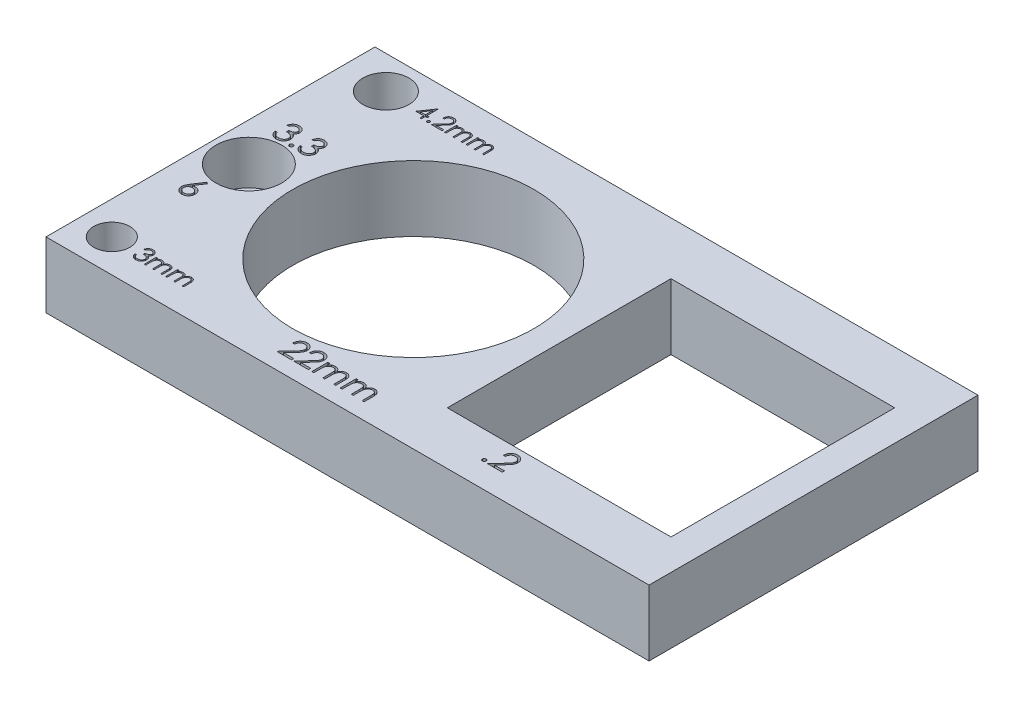
from build123d import *

# Parameters (mm, degrees)
SKETCH1_W               = 55
SKETCH1_H               = 30
BOSS_EXTRUDE1_DEPTH     = 6
CUT_EXTRUDE2_DEPTH      = 32.894356868
CUT_EXTRUDE2_DEPTH_BACK = 32.894356868
SKETCH2_W               = 20.4
SKETCH2_H               = 20.4
SKETCH4_R               = 2.1
CUT_EXTRUDE3_DEPTH      = 10
SKETCH5_R               = 1.65
CUT_EXTRUDE4_DEPTH      = 32.894356868
CUT_EXTRUDE5_DEPTH      = 1
CUT_EXTRUDE6_DEPTH      = 1
SKETCH8_R               = 1.65
CUT_EXTRUDE7_DEPTH      = 32.894357001
SKETCH9_R               = 3
CUT_EXTRUDE8_DEPTH      = 4
CUT_EXTRUDE9_DEPTH      = 1
CUT_EXTRUDE10_DEPTH     = 1
SKETCH12_R              = 11
CUT_EXTRUDE11_DEPTH     = 10
CUT_EXTRUDE12_DEPTH     = 1


with BuildPart() as part:
    # Sketch1 → Boss-Extrude1 (new body)
    with BuildSketch(Plane(origin=(0, 0, 0), x_dir=(1, 0, 0), z_dir=(0, 1, 0))):
        Rectangle(SKETCH1_W, SKETCH1_H)
    extrude(amount=BOSS_EXTRUDE1_DEPTH)

    # Sketch2 → Cut-Extrude2 (cut, two sides: drawn at the far end of the back side and taken through both)
    with BuildSketch(Plane(origin=(0, 0, 0), x_dir=(1, 0, 0), z_dir=(0, 1, 0)).offset(-CUT_EXTRUDE2_DEPTH_BACK)):
        with Locations((14.5, 0)):
            Rectangle(SKETCH2_W, SKETCH2_H)
    extrude(amount=CUT_EXTRUDE2_DEPTH + CUT_EXTRUDE2_DEPTH_BACK, mode=Mode.SUBTRACT)

    # Sketch4 → Cut-Extrude3 (cut)
    with BuildSketch(Plane(origin=(0, 0, 0), x_dir=(1, 0, 0), z_dir=(0, 1, 0))):
        with Locations(Location((-23.5, 12, 0), (0, 0, 90))):
            Circle(SKETCH4_R)
    extrude(amount=CUT_EXTRUDE3_DEPTH, mode=Mode.SUBTRACT)

    # Sketch5 → Cut-Extrude4 (cut, through all)
    with BuildSketch(Plane(origin=(0, 6, 0), x_dir=(1, 0, 0), z_dir=(0, 1, 0))):
        with Locations(Location((-24.5, -12, 0), (0, 0, 270))):
            Circle(SKETCH5_R)
    extrude(amount=-CUT_EXTRUDE4_DEPTH, mode=Mode.SUBTRACT)

    # Sketch6 → Cut-Extrude5 (cut)
    # profile 1 of 5: a face of its own
    with BuildSketch(Plane(origin=(0, 6, 0), x_dir=(1, 0, 0), z_dir=(0, 1, 0))):
        Polygon((-19.734771819, 12.982332809), (-19.707428069, 12.982332809), (-19.707428069, 11.94387127), (-19.534351146, 11.94387127), (-19.534351146, 11.790025117), (-19.707428069, 11.790025117), (-19.707428069, 11.44387127), (-19.842043454, 11.44387127), (-19.842043454, 11.790025117), (-20.553581915, 11.790025117), align=None)
        Polygon((-19.842043454, 11.94387127), (-19.842043454, 12.595313578), (-20.289158838, 11.94387127), align=None, mode=Mode.SUBTRACT)
    # profile 2 of 5: a face of its own
    with BuildSketch(Plane(origin=(0, 6, 0), x_dir=(1, 0, 0), z_dir=(0, 1, 0))):
        with BuildLine():
            add(Edge.make_bspline(
                [(-19.159351146, 11.674640501), (-19.150998198, 11.674144144), (-19.13462322, 11.673171094), (-19.110949308, 11.666495377), (-19.089523025, 11.654641665), (-19.070437777, 11.638843331), (-19.05470643, 11.619688047), (-19.042430279, 11.598432658), (-19.035812714, 11.574560547), (-19.034846752, 11.558090686), (-19.034351146, 11.549640501)],
                knots=[0, 0, 0, 0, 1.020151414, 1.999887582, 2.974338812, 3.990962822, 5.007586832, 5.987933904, 6.967670073, 8, 8, 8, 8], degree=3))
            add(Edge.make_bspline(
                [(-19.034351146, 11.549640501), (-19.034863546, 11.54139336), (-19.035873992, 11.525130118), (-19.04241511, 11.501438063), (-19.054799989, 11.48016939), (-19.070329271, 11.460754187), (-19.089527743, 11.444922386), (-19.110999963, 11.433169524), (-19.134567645, 11.426015818), (-19.150988926, 11.425104548), (-19.159351146, 11.424640501)],
                knots=[0, 0, 0, 0, 1.009421747, 1.99056486, 2.972319754, 3.999869655, 5.017953583, 5.993804169, 6.978383603, 8, 8, 8, 8], degree=3))
            add(Edge.make_bspline(
                [(-19.159351146, 11.424640501), (-19.167719391, 11.425087757), (-19.184056398, 11.425960918), (-19.20753611, 11.433316406), (-19.229139096, 11.444812175), (-19.24833383, 11.460783708), (-19.263993175, 11.480069483), (-19.275832625, 11.501584539), (-19.282942689, 11.525062298), (-19.283877777, 11.541380002), (-19.284351146, 11.549640501)],
                knots=[0, 0, 0, 0, 1.022052826, 1.995314843, 2.982371812, 4.00089066, 5.028879526, 6.005146991, 6.990147033, 8, 8, 8, 8], degree=3))
            add(Edge.make_bspline(
                [(-19.284351146, 11.549640501), (-19.283895961, 11.558104521), (-19.283007267, 11.574629481), (-19.275817698, 11.598286241), (-19.264085036, 11.619787001), (-19.248225581, 11.638814107), (-19.22914374, 11.654751522), (-19.207588223, 11.666350719), (-19.183999849, 11.673225182), (-19.167709875, 11.674160546), (-19.159351146, 11.674640501)],
                knots=[0, 0, 0, 0, 1.032775665, 2.016367738, 2.991239715, 4.008302682, 5.025365648, 6.011011707, 6.979408107, 8, 8, 8, 8], degree=3))
        make_face()
    # profile 3 of 5: a face of its own
    with BuildSketch(Plane(origin=(0, 6, 0), x_dir=(1, 0, 0), z_dir=(0, 1, 0))):
        with BuildLine():
            Line((-18.649735761, 12.482332809), (-18.784351146, 12.482332809))
            add(Edge.make_bspline(
                [(-18.784351146, 12.482332809), (-18.783473795, 12.500191761), (-18.7817507, 12.535266267), (-18.773681433, 12.586405084), (-18.762135343, 12.635285712), (-18.745810434, 12.681515675), (-18.725536315, 12.725503735), (-18.701223446, 12.767075171), (-18.672426082, 12.806071394), (-18.639766053, 12.842130899), (-18.604293779, 12.875211286), (-18.566019805, 12.903777819), (-18.525800508, 12.927913964), (-18.483757908, 12.948091639), (-18.439417666, 12.963237287), (-18.393182156, 12.974475133), (-18.34484824, 12.981236424), (-18.311916802, 12.981963189), (-18.295168454, 12.982332809)],
                knots=[0, 0, 0, 0, 1.10065271, 2.161652631, 3.183658789, 4.190468796, 5.17591951, 6.163126047, 7.15150782, 8.156236427, 9.156009102, 10.134482811, 11.092018607, 12.041330605, 13.001268258, 13.972401359, 14.968799086, 16, 16, 16, 16], degree=3))
            add(Edge.make_bspline(
                [(-18.295168454, 12.982332809), (-18.278720708, 12.981947756), (-18.246401474, 12.981191141), (-18.199232039, 12.974693557), (-18.154327485, 12.964516875), (-18.111775585, 12.95023884), (-18.071915843, 12.931045513), (-18.034448824, 12.907989425), (-17.998928476, 12.881323783), (-17.96695414, 12.849929292), (-17.937593535, 12.816413984), (-17.912263997, 12.780633454), (-17.890572641, 12.743678046), (-17.872492207, 12.70526596), (-17.859182433, 12.665035519), (-17.849077487, 12.623572432), (-17.843365738, 12.580447513), (-17.842489128, 12.551258989), (-17.842043454, 12.536419347)],
                knots=[0, 0, 0, 0, 1.111607364, 2.184268762, 3.212621178, 4.221274766, 5.211760367, 6.196651075, 7.1921475, 8.207485113, 9.220403448, 10.201281604, 11.166441695, 12.114753415, 13.065576456, 14.026450734, 14.996634279, 16, 16, 16, 16], degree=3))
            add(Edge.make_bspline(
                [(-17.842043454, 12.536419347), (-17.842769138, 12.515527418), (-17.844207771, 12.474110184), (-17.856513933, 12.413246671), (-17.875733866, 12.354278063), (-17.89887559, 12.306819219), (-17.922220923, 12.268576293), (-17.943258427, 12.237089706), (-17.967886203, 12.203187362), (-17.996462702, 12.166982789), (-18.02839679, 12.128192401), (-18.063977717, 12.086839631), (-18.10345921, 12.04335173), (-18.131169996, 12.013649329), (-18.145529031, 11.99825829)],
                knots=[0, 0, 0, 0, 1.184426356, 2.348067706, 3.509069118, 4.696110526, 5.333549288, 6.050745305, 6.844228056, 7.710549037, 8.667450064, 9.695053472, 10.805634456, 12, 12, 12, 12], degree=3))
            Line((-18.145529031, 11.99825829), (-18.520829511, 11.597717424))
            Line((-18.520829511, 11.597717424), (-17.822812684, 11.597717424))
            Line((-17.822812684, 11.597717424), (-17.822812684, 11.44387127))
            Line((-17.822812684, 11.44387127), (-18.842043454, 11.44387127))
            Line((-18.842043454, 11.44387127), (-18.260312684, 12.06466454))
            add(Edge.make_bspline(
                [(-18.260312684, 12.06466454), (-18.246149304, 12.079449528), (-18.21894435, 12.107848465), (-18.180466103, 12.149309734), (-18.145906536, 12.187773823), (-18.115041939, 12.223168058), (-18.088541866, 12.256010158), (-18.065025195, 12.28523646), (-18.046182799, 12.312131224), (-18.025733343, 12.343305773), (-18.005927351, 12.381368195), (-17.98890777, 12.427882633), (-17.978529978, 12.475765741), (-17.977285049, 12.508123757), (-17.976658838, 12.524400117)],
                knots=[0, 0, 0, 0, 1.329631726, 2.553950428, 3.673215718, 4.687767853, 5.603093632, 6.413772471, 7.123043292, 7.734684054, 8.834405432, 9.900288307, 10.943827018, 12, 12, 12, 12], degree=3))
            add(Edge.make_bspline(
                [(-17.976658838, 12.524400117), (-17.976931299, 12.534635002), (-17.977468268, 12.554805995), (-17.982207281, 12.584379891), (-17.989368926, 12.612907669), (-17.99963118, 12.640477077), (-18.013176925, 12.666810928), (-18.029665517, 12.691941276), (-18.04868983, 12.716236547), (-18.070697517, 12.739016532), (-18.094873882, 12.759879906), (-18.120414275, 12.778361657), (-18.147435748, 12.79380699), (-18.175824372, 12.806468489), (-18.205501002, 12.816400795), (-18.236523035, 12.823283043), (-18.268804757, 12.827604108), (-18.290847683, 12.828188753), (-18.302079511, 12.828486655)],
                knots=[0, 0, 0, 0, 0.991446411, 1.95395049, 2.89581595, 3.838931463, 4.798493298, 5.75982156, 6.748411868, 7.785213223, 8.824556874, 9.840280684, 10.836137867, 11.835679398, 12.848801643, 13.863922112, 14.911575587, 16, 16, 16, 16], degree=3))
            add(Edge.make_bspline(
                [(-18.302079511, 12.828486655), (-18.313809868, 12.828180213), (-18.336846352, 12.82757841), (-18.370668795, 12.823368697), (-18.402934128, 12.816106194), (-18.433723515, 12.806173334), (-18.463089052, 12.793548241), (-18.490887928, 12.777823208), (-18.517057738, 12.759058854), (-18.541647676, 12.73778433), (-18.564303667, 12.714098215), (-18.584209471, 12.687693945), (-18.60160262, 12.659053624), (-18.616778006, 12.628254531), (-18.629101873, 12.595017197), (-18.638518938, 12.559459609), (-18.645970443, 12.52173616), (-18.648459809, 12.495685409), (-18.649735761, 12.482332809)],
                knots=[0, 0, 0, 0, 1.031018746, 2.02475058, 2.990194455, 3.934040569, 4.864654155, 5.795059489, 6.735614925, 7.690564532, 8.649604399, 9.611025574, 10.590972636, 11.591080095, 12.624614302, 13.701020113, 14.821632451, 16, 16, 16, 16], degree=3))
        make_face()
    # profile 4 of 5: a face of its own
    with BuildSketch(Plane(origin=(0, 6, 0), x_dir=(1, 0, 0), z_dir=(0, 1, 0))):
        with BuildLine():
            Line((-17.592043454, 12.540025117), (-17.457428069, 12.540025117))
            Line((-17.457428069, 12.540025117), (-17.457428069, 12.349520309))
            add(Edge.make_bspline(
                [(-17.457428069, 12.349520309), (-17.445306376, 12.366186424), (-17.422080051, 12.398120298), (-17.383994771, 12.440201848), (-17.345947866, 12.475913915), (-17.318547845, 12.49466086), (-17.3053848, 12.503666943)],
                knots=[0, 0, 0, 0, 1.134379233, 2.173579362, 3.122582517, 4, 4, 4, 4], degree=3))
            add(Edge.make_bspline(
                [(-17.3053848, 12.503666943), (-17.287442802, 12.512240671), (-17.251872273, 12.529238334), (-17.195549748, 12.546481288), (-17.137917747, 12.55707776), (-17.098999941, 12.55852692), (-17.079423261, 12.559255886)],
                knots=[0, 0, 0, 0, 1.014936303, 2.012140481, 3.000054389, 4, 4, 4, 4], degree=3))
            add(Edge.make_bspline(
                [(-17.079423261, 12.559255886), (-17.066183406, 12.558807904), (-17.039982443, 12.557921372), (-17.00116069, 12.552152786), (-16.963507, 12.542181569), (-16.927243844, 12.528292716), (-16.893077839, 12.511472707), (-16.861753897, 12.491737118), (-16.833629236, 12.469581228), (-16.808718071, 12.444004543), (-16.78631706, 12.414288858), (-16.76571184, 12.379632751), (-16.746672464, 12.339258039), (-16.736120474, 12.309958093), (-16.730565088, 12.294532328)],
                knots=[0, 0, 0, 0, 1.009824226, 1.998387844, 2.986035974, 3.974953746, 4.955485308, 5.885931332, 6.793869504, 7.679848016, 8.601185859, 9.625726857, 10.749998409, 12, 12, 12, 12], degree=3))
            add(Edge.make_bspline(
                [(-16.730565088, 12.294532328), (-16.724688838, 12.305128508), (-16.713125202, 12.325980301), (-16.6937085, 12.355490985), (-16.673365159, 12.383093896), (-16.651921805, 12.408810935), (-16.629454125, 12.432515105), (-16.605856382, 12.454284777), (-16.581262904, 12.47421344), (-16.54706623, 12.497494794), (-16.502575112, 12.522223872), (-16.446480206, 12.543664634), (-16.388130132, 12.556914403), (-16.348522547, 12.558470234), (-16.328521819, 12.559255886)],
                knots=[0, 0, 0, 0, 0.86119277, 1.694706429, 2.50939023, 3.298075842, 4.073795165, 4.829715201, 5.57930267, 6.321991688, 7.768977793, 9.186738141, 10.579381044, 12, 12, 12, 12], degree=3))
            add(Edge.make_bspline(
                [(-16.328521819, 12.559255886), (-16.310144049, 12.558562791), (-16.274176969, 12.557206338), (-16.221815284, 12.546554849), (-16.172983082, 12.528264429), (-16.127778621, 12.503307156), (-16.086995844, 12.471944649), (-16.051545997, 12.434629433), (-16.021644412, 12.391625451), (-16.00211071, 12.351171742), (-15.988861311, 12.315456599), (-15.98069221, 12.285025332), (-15.973475198, 12.251531809), (-15.967483236, 12.214935983), (-15.963103856, 12.175108579), (-15.959859264, 12.132114775), (-15.957663233, 12.085921156), (-15.957508059, 12.054050227), (-15.957428069, 12.03762127)],
                knots=[0, 0, 0, 0, 1.209669288, 2.367440248, 3.500751976, 4.631527125, 5.755587489, 6.87532382, 8.007944318, 9.190864318, 9.82315674, 10.514484317, 11.263564316, 12.079023757, 12.955305781, 13.901327259, 14.918167583, 16, 16, 16, 16], degree=3))
            Line((-15.957428069, 12.03762127), (-15.957428069, 11.44387127))
            Line((-15.957428069, 11.44387127), (-16.092043454, 11.44387127))
            Line((-16.092043454, 11.44387127), (-16.092043454, 12.038222232))
            add(Edge.make_bspline(
                [(-16.092043454, 12.038222232), (-16.092076832, 12.052245335), (-16.09214098, 12.079195607), (-16.093295394, 12.117875229), (-16.095470528, 12.153133096), (-16.098013945, 12.184921134), (-16.101547006, 12.213313472), (-16.106109548, 12.23825308), (-16.11094284, 12.259936142), (-16.11897255, 12.283973019), (-16.131807361, 12.310488824), (-16.15135771, 12.339084642), (-16.175987755, 12.363976413), (-16.204427822, 12.385584263), (-16.236805727, 12.403152967), (-16.272490608, 12.415699828), (-16.311260916, 12.423466776), (-16.338099254, 12.424240783), (-16.351959319, 12.424640501)],
                knots=[0, 0, 0, 0, 1.253487763, 2.409012846, 3.458416907, 4.410876679, 5.259312806, 6.014470957, 6.676830364, 7.243083969, 8.276244668, 9.299465089, 10.325150304, 11.392391894, 12.482080715, 13.603491619, 14.762376348, 16, 16, 16, 16], degree=3))
            add(Edge.make_bspline(
                [(-16.351959319, 12.424640501), (-16.368960728, 12.424033577), (-16.402561976, 12.422834063), (-16.451610041, 12.410588117), (-16.498740477, 12.392125153), (-16.542546962, 12.365368385), (-16.582844587, 12.333307658), (-16.617515835, 12.295186403), (-16.6461582, 12.252059291), (-16.665552761, 12.212139276), (-16.677805319, 12.176280943), (-16.685895425, 12.144953498), (-16.692188308, 12.109347111), (-16.698089963, 12.069701044), (-16.701941846, 12.025742395), (-16.705442577, 11.977674509), (-16.70708009, 11.925352812), (-16.707309144, 11.889084231), (-16.707428069, 11.870253482)],
                knots=[0, 0, 0, 0, 1.090531906, 2.155305635, 3.229839962, 4.33261226, 5.44038871, 6.529323825, 7.629011124, 8.757537029, 9.370236727, 10.061839251, 10.834451254, 11.692844982, 12.636905849, 13.66920014, 14.789842145, 16, 16, 16, 16], degree=3))
            Line((-16.707428069, 11.870253482), (-16.707428069, 11.44387127))
            Line((-16.707428069, 11.44387127), (-16.842043454, 11.44387127))
            Line((-16.842043454, 11.44387127), (-16.842043454, 12.001263097))
            add(Edge.make_bspline(
                [(-16.842043454, 12.001263097), (-16.842077496, 12.016988805), (-16.842142989, 12.047243487), (-16.843289982, 12.090629348), (-16.845469962, 12.130092668), (-16.847990198, 12.165587581), (-16.851615988, 12.197049579), (-16.855734458, 12.224647332), (-16.860598148, 12.248311654), (-16.868650956, 12.274267391), (-16.880957156, 12.302862072), (-16.900752126, 12.333351081), (-16.925441089, 12.360037409), (-16.954400036, 12.382819729), (-16.986973899, 12.401651793), (-17.022966785, 12.415220258), (-17.062054605, 12.423116382), (-17.089002194, 12.42412288), (-17.102860761, 12.424640501)],
                knots=[0, 0, 0, 0, 1.320475261, 2.540461679, 3.643808994, 4.639130445, 5.527981419, 6.302341397, 6.981980563, 7.553956391, 8.582137848, 9.585246428, 10.591171744, 11.620968678, 12.668337649, 13.738356861, 14.836885341, 16, 16, 16, 16], degree=3))
            add(Edge.make_bspline(
                [(-17.102860761, 12.424640501), (-17.119153423, 12.42398459), (-17.15162412, 12.422677382), (-17.199324964, 12.410911264), (-17.245390257, 12.392480946), (-17.289085128, 12.366912453), (-17.329231192, 12.335241419), (-17.364377592, 12.297992178), (-17.393924389, 12.255628306), (-17.413523738, 12.216129228), (-17.426165941, 12.181169253), (-17.434563942, 12.151447418), (-17.441780924, 12.118447312), (-17.447144077, 12.082067121), (-17.452321397, 12.042543795), (-17.454820101, 11.999680442), (-17.457250771, 11.953513833), (-17.45736752, 11.921639885), (-17.457428069, 11.905109251)],
                knots=[0, 0, 0, 0, 1.098833095, 2.189935336, 3.297829714, 4.440610912, 5.596351641, 6.740013378, 7.886572111, 9.072425424, 9.705826452, 10.395263256, 11.156850408, 11.985370555, 12.878090359, 13.847760091, 14.883794034, 16, 16, 16, 16], degree=3))
            Line((-17.457428069, 11.905109251), (-17.457428069, 11.44387127))
            Line((-17.457428069, 11.44387127), (-17.592043454, 11.44387127))
            Line((-17.592043454, 11.44387127), (-17.592043454, 12.540025117))
        make_face()
    # profile 5 of 5: a face of its own
    with BuildSketch(Plane(origin=(0, 6, 0), x_dir=(1, 0, 0), z_dir=(0, 1, 0))):
        with BuildLine():
            Line((-15.649735761, 12.540025117), (-15.515120377, 12.540025117))
            Line((-15.515120377, 12.540025117), (-15.515120377, 12.349520309))
            add(Edge.make_bspline(
                [(-15.515120377, 12.349520309), (-15.502998684, 12.366186424), (-15.479772358, 12.398120298), (-15.441687079, 12.440201848), (-15.403640173, 12.475913915), (-15.376240153, 12.49466086), (-15.363077108, 12.503666943)],
                knots=[0, 0, 0, 0, 1.134379233, 2.173579362, 3.122582517, 4, 4, 4, 4], degree=3))
            add(Edge.make_bspline(
                [(-15.363077108, 12.503666943), (-15.345135109, 12.512240671), (-15.309564581, 12.529238334), (-15.253242056, 12.546481288), (-15.195610055, 12.55707776), (-15.156692249, 12.55852692), (-15.137115569, 12.559255886)],
                knots=[0, 0, 0, 0, 1.014936303, 2.012140481, 3.000054389, 4, 4, 4, 4], degree=3))
            add(Edge.make_bspline(
                [(-15.137115569, 12.559255886), (-15.123875713, 12.558807904), (-15.097674751, 12.557921372), (-15.058852998, 12.552152786), (-15.021199307, 12.542181569), (-14.984936152, 12.528292716), (-14.950770146, 12.511472707), (-14.919446205, 12.491737118), (-14.891321544, 12.469581228), (-14.866410379, 12.444004543), (-14.844009368, 12.414288858), (-14.823404148, 12.379632751), (-14.804364771, 12.339258039), (-14.793812782, 12.309958093), (-14.788257396, 12.294532328)],
                knots=[0, 0, 0, 0, 1.009824226, 1.998387844, 2.986035974, 3.974953746, 4.955485308, 5.885931332, 6.793869504, 7.679848016, 8.601185859, 9.625726857, 10.749998409, 12, 12, 12, 12], degree=3))
            add(Edge.make_bspline(
                [(-14.788257396, 12.294532328), (-14.782381145, 12.305128508), (-14.77081751, 12.325980301), (-14.751400808, 12.355490985), (-14.731057467, 12.383093896), (-14.709614112, 12.408810935), (-14.687146432, 12.432515105), (-14.663548689, 12.454284777), (-14.638955212, 12.47421344), (-14.604758537, 12.497494794), (-14.56026742, 12.522223872), (-14.504172514, 12.543664634), (-14.44582244, 12.556914403), (-14.406214855, 12.558470234), (-14.386214127, 12.559255886)],
                knots=[0, 0, 0, 0, 0.86119277, 1.694706429, 2.50939023, 3.298075842, 4.073795165, 4.829715201, 5.57930267, 6.321991688, 7.768977793, 9.186738141, 10.579381044, 12, 12, 12, 12], degree=3))
            add(Edge.make_bspline(
                [(-14.386214127, 12.559255886), (-14.367836357, 12.558562791), (-14.331869277, 12.557206338), (-14.279507592, 12.546554849), (-14.23067539, 12.528264429), (-14.185470928, 12.503307156), (-14.144688151, 12.471944649), (-14.109238304, 12.434629433), (-14.07933672, 12.391625451), (-14.059803017, 12.351171742), (-14.046553618, 12.315456599), (-14.038384518, 12.285025332), (-14.031167506, 12.251531809), (-14.025175544, 12.214935983), (-14.020796164, 12.175108579), (-14.017551572, 12.132114775), (-14.01535554, 12.085921156), (-14.015200366, 12.054050227), (-14.015120377, 12.03762127)],
                knots=[0, 0, 0, 0, 1.209669288, 2.367440248, 3.500751976, 4.631527125, 5.755587489, 6.87532382, 8.007944318, 9.190864318, 9.82315674, 10.514484317, 11.263564316, 12.079023757, 12.955305781, 13.901327259, 14.918167583, 16, 16, 16, 16], degree=3))
            Line((-14.015120377, 12.03762127), (-14.015120377, 11.44387127))
            Line((-14.015120377, 11.44387127), (-14.149735761, 11.44387127))
            Line((-14.149735761, 11.44387127), (-14.149735761, 12.038222232))
            add(Edge.make_bspline(
                [(-14.149735761, 12.038222232), (-14.14976914, 12.052245335), (-14.149833288, 12.079195607), (-14.150987702, 12.117875229), (-14.153162836, 12.153133096), (-14.155706253, 12.184921134), (-14.159239314, 12.213313472), (-14.163801856, 12.23825308), (-14.168635148, 12.259936142), (-14.176664858, 12.283973019), (-14.189499669, 12.310488824), (-14.209050017, 12.339084642), (-14.233680063, 12.363976413), (-14.26212013, 12.385584263), (-14.294498035, 12.403152967), (-14.330182916, 12.415699828), (-14.368953224, 12.423466776), (-14.395791562, 12.424240783), (-14.409651627, 12.424640501)],
                knots=[0, 0, 0, 0, 1.253487763, 2.409012846, 3.458416907, 4.410876679, 5.259312806, 6.014470957, 6.676830364, 7.243083969, 8.276244668, 9.299465089, 10.325150304, 11.392391894, 12.482080715, 13.603491619, 14.762376348, 16, 16, 16, 16], degree=3))
            add(Edge.make_bspline(
                [(-14.409651627, 12.424640501), (-14.426653036, 12.424033577), (-14.460254283, 12.422834063), (-14.509302349, 12.410588117), (-14.556432785, 12.392125153), (-14.60023927, 12.365368385), (-14.640536895, 12.333307658), (-14.675208142, 12.295186403), (-14.703850508, 12.252059291), (-14.723245069, 12.212139276), (-14.735497626, 12.176280943), (-14.743587733, 12.144953498), (-14.749880615, 12.109347111), (-14.755782271, 12.069701044), (-14.759634154, 12.025742395), (-14.763134885, 11.977674509), (-14.764772398, 11.925352812), (-14.765001451, 11.889084231), (-14.765120377, 11.870253482)],
                knots=[0, 0, 0, 0, 1.090531906, 2.155305635, 3.229839962, 4.33261226, 5.44038871, 6.529323825, 7.629011124, 8.757537029, 9.370236727, 10.061839251, 10.834451254, 11.692844982, 12.636905849, 13.66920014, 14.789842145, 16, 16, 16, 16], degree=3))
            Line((-14.765120377, 11.870253482), (-14.765120377, 11.44387127))
            Line((-14.765120377, 11.44387127), (-14.899735761, 11.44387127))
            Line((-14.899735761, 11.44387127), (-14.899735761, 12.001263097))
            add(Edge.make_bspline(
                [(-14.899735761, 12.001263097), (-14.899769803, 12.016988805), (-14.899835296, 12.047243487), (-14.900982289, 12.090629348), (-14.90316227, 12.130092668), (-14.905682505, 12.165587581), (-14.909308296, 12.197049579), (-14.913426765, 12.224647332), (-14.918290456, 12.248311654), (-14.926343263, 12.274267391), (-14.938649464, 12.302862072), (-14.958444434, 12.333351081), (-14.983133397, 12.360037409), (-15.012092343, 12.382819729), (-15.044666207, 12.401651793), (-15.080659093, 12.415220258), (-15.119746913, 12.423116382), (-15.146694501, 12.42412288), (-15.160553069, 12.424640501)],
                knots=[0, 0, 0, 0, 1.320475261, 2.540461679, 3.643808994, 4.639130445, 5.527981419, 6.302341397, 6.981980563, 7.553956391, 8.582137848, 9.585246428, 10.591171744, 11.620968678, 12.668337649, 13.738356861, 14.836885341, 16, 16, 16, 16], degree=3))
            add(Edge.make_bspline(
                [(-15.160553069, 12.424640501), (-15.176845731, 12.42398459), (-15.209316428, 12.422677382), (-15.257017272, 12.410911264), (-15.303082565, 12.392480946), (-15.346777436, 12.366912453), (-15.3869235, 12.335241419), (-15.4220699, 12.297992178), (-15.451616697, 12.255628306), (-15.471216046, 12.216129228), (-15.483858249, 12.181169253), (-15.49225625, 12.151447418), (-15.499473232, 12.118447312), (-15.504836384, 12.082067121), (-15.510013705, 12.042543795), (-15.512512409, 11.999680442), (-15.514943079, 11.953513833), (-15.515059828, 11.921639885), (-15.515120377, 11.905109251)],
                knots=[0, 0, 0, 0, 1.098833095, 2.189935336, 3.297829714, 4.440610912, 5.596351641, 6.740013378, 7.886572111, 9.072425424, 9.705826452, 10.395263256, 11.156850408, 11.985370555, 12.878090359, 13.847760091, 14.883794034, 16, 16, 16, 16], degree=3))
            Line((-15.515120377, 11.905109251), (-15.515120377, 11.44387127))
            Line((-15.515120377, 11.44387127), (-15.649735761, 11.44387127))
            Line((-15.649735761, 11.44387127), (-15.649735761, 12.540025117))
        make_face()
    extrude(amount=-CUT_EXTRUDE5_DEPTH, mode=Mode.SUBTRACT)

    # Sketch7 → Cut-Extrude6 (cut)
    with BuildSketch(Plane(origin=(0, 6, 0), x_dir=(1, 0, 0), z_dir=(0, 1, 0))):
        with BuildLine():
            Line((-21.919061271, -11.521827625), (-22.053676655, -11.521827625))
            add(Edge.make_bspline(
                [(-22.053676655, -11.521827625), (-22.050029705, -11.506727989), (-22.042900215, -11.477209436), (-22.028029827, -11.435034896), (-22.011830146, -11.395124815), (-21.992377673, -11.358226498), (-21.971159635, -11.323598396), (-21.946849897, -11.292025915), (-21.920570016, -11.262706072), (-21.891502181, -11.236686113), (-21.861018469, -11.213124229), (-21.828689346, -11.193034919), (-21.795165249, -11.175753139), (-21.760213906, -11.161515897), (-21.723731261, -11.150790673), (-21.686047137, -11.143009184), (-21.647062779, -11.13795585), (-21.620599526, -11.137462666), (-21.607162232, -11.137212241)],
                knots=[0, 0, 0, 0, 1.162005537, 2.271625781, 3.343758855, 4.383309926, 5.390229558, 6.379919256, 7.361854164, 8.333198761, 9.295911338, 10.242430842, 11.177959212, 12.116337295, 13.062827104, 14.020064771, 14.994644689, 16, 16, 16, 16], degree=3))
            add(Edge.make_bspline(
                [(-21.607162232, -11.137212241), (-21.587583914, -11.137803339), (-21.548854338, -11.138972643), (-21.491955889, -11.149650259), (-21.437087253, -11.166546744), (-21.384849004, -11.189892627), (-21.336326818, -11.21868719), (-21.293154167, -11.252957791), (-21.255916233, -11.292043206), (-21.224675786, -11.335214305), (-21.200215072, -11.381352381), (-21.182178055, -11.428838162), (-21.171197334, -11.477559007), (-21.169774239, -11.510454984), (-21.169061271, -11.526935798)],
                knots=[0, 0, 0, 0, 1.083050992, 2.142477498, 3.193116406, 4.255571735, 5.30263384, 6.308962982, 7.297363603, 8.282367274, 9.249857812, 10.179914175, 11.08814088, 12, 12, 12, 12], degree=3))
            add(Edge.make_bspline(
                [(-21.169061271, -11.526935798), (-21.169559953, -11.542795853), (-21.170535796, -11.573831519), (-21.178821669, -11.619140732), (-21.192765782, -11.661844275), (-21.212081395, -11.702121916), (-21.237084916, -11.739718276), (-21.267373215, -11.774717944), (-21.30316007, -11.807276154), (-21.330279615, -11.825927357), (-21.344241559, -11.835529548)],
                knots=[0, 0, 0, 0, 1.024540389, 2.004866551, 2.965041327, 3.920577974, 4.882998113, 5.874504559, 6.905732034, 8, 8, 8, 8], degree=3))
            add(Edge.make_bspline(
                [(-21.344241559, -11.835529548), (-21.328285093, -11.843234479), (-21.296670718, -11.858500175), (-21.253577634, -11.888438357), (-21.214458545, -11.923005363), (-21.192642665, -11.949980786), (-21.181681463, -11.963534356)],
                knots=[0, 0, 0, 0, 1.015518401, 2.012035669, 3.001164323, 4, 4, 4, 4], degree=3))
            add(Edge.make_bspline(
                [(-21.181681463, -11.963534356), (-21.174463745, -11.97341625), (-21.160146504, -11.993018214), (-21.142474132, -12.024533825), (-21.126441654, -12.056398749), (-21.113948703, -12.089467066), (-21.104274189, -12.1233555), (-21.097358747, -12.158122241), (-21.093062686, -12.19379568), (-21.09244745, -12.2179296), (-21.092138194, -12.230060798)],
                knots=[0, 0, 0, 0, 1.025084078, 2.033381695, 3.024893161, 4.013698104, 4.991890475, 5.976764909, 6.982997093, 8, 8, 8, 8], degree=3))
            add(Edge.make_bspline(
                [(-21.092138194, -12.230060798), (-21.092907271, -12.251064965), (-21.094441806, -12.292974451), (-21.108157838, -12.354892189), (-21.129420655, -12.415417404), (-21.159616485, -12.473306621), (-21.196416846, -12.527469641), (-21.240198556, -12.575930917), (-21.29046416, -12.617587461), (-21.346523724, -12.652391845), (-21.407259636, -12.680213812), (-21.472220604, -12.699524144), (-21.540470627, -12.712101001), (-21.587273755, -12.713449659), (-21.611068482, -12.714135318)],
                knots=[0, 0, 0, 0, 0.955779014, 1.907060117, 2.875433937, 3.871313158, 4.872415639, 5.851225146, 6.836215519, 7.83643374, 8.849228613, 9.86973379, 10.916971861, 12, 12, 12, 12], degree=3))
            add(Edge.make_bspline(
                [(-21.611068482, -12.714135318), (-21.627105325, -12.713763226), (-21.658660484, -12.713031074), (-21.705050555, -12.70802596), (-21.749331284, -12.698884529), (-21.79156254, -12.686583112), (-21.831781841, -12.670986651), (-21.869866458, -12.651564352), (-21.906050698, -12.628716566), (-21.939993105, -12.602173599), (-21.971689634, -12.572481597), (-22.000297945, -12.539113449), (-22.026294999, -12.502685991), (-22.048984701, -12.462776109), (-22.069400538, -12.419899571), (-22.086192377, -12.373507357), (-22.100971906, -12.324014205), (-22.107843391, -12.289523745), (-22.111368963, -12.271827625)],
                knots=[0, 0, 0, 0, 1.048658725, 2.063410685, 3.046034179, 4.001477787, 4.936774919, 5.862367409, 6.792675028, 7.730719943, 8.675894397, 9.627829632, 10.600096036, 11.597688215, 12.626045268, 13.701542398, 14.82072376, 16, 16, 16, 16], degree=3))
            Line((-22.111368963, -12.271827625), (-21.976753578, -12.271827625))
            add(Edge.make_bspline(
                [(-21.976753578, -12.271827625), (-21.973246453, -12.283377202), (-21.966424791, -12.305842133), (-21.954812949, -12.338173693), (-21.941583689, -12.367812858), (-21.927391736, -12.394977053), (-21.912486687, -12.419933797), (-21.895808862, -12.44202317), (-21.878593514, -12.462215399), (-21.865616649, -12.473591662), (-21.859265598, -12.479159356)],
                knots=[0, 0, 0, 0, 1.198163088, 2.33053128, 3.407730985, 4.417276592, 5.372219308, 6.28897303, 7.162600585, 8, 8, 8, 8], degree=3))
            add(Edge.make_bspline(
                [(-21.859265598, -12.479159356), (-21.850867065, -12.485634356), (-21.834095924, -12.49856437), (-21.806766682, -12.515065068), (-21.778024588, -12.52936265), (-21.74724687, -12.540284234), (-21.715097683, -12.549531803), (-21.681057383, -12.555583454), (-21.64542629, -12.559735527), (-21.621097249, -12.560101927), (-21.608664636, -12.560289164)],
                knots=[0, 0, 0, 0, 0.946170439, 1.889420265, 2.845303464, 3.807233317, 4.801018734, 5.828864929, 6.890507805, 8, 8, 8, 8], degree=3))
            add(Edge.make_bspline(
                [(-21.608664636, -12.560289164), (-21.594627421, -12.560025204), (-21.567178858, -12.559509054), (-21.527126775, -12.554762323), (-21.489023583, -12.547849289), (-21.453292329, -12.537172296), (-21.419464969, -12.523980503), (-21.388015691, -12.5074169), (-21.358531645, -12.487983448), (-21.331390471, -12.465895237), (-21.306985254, -12.441714596), (-21.285496891, -12.41642328), (-21.267229179, -12.390127925), (-21.25249336, -12.362683016), (-21.24085741, -12.334202203), (-21.232936038, -12.304605562), (-21.227428246, -12.274135305), (-21.226979698, -12.25342289), (-21.226753578, -12.242981471)],
                knots=[0, 0, 0, 0, 1.217147791, 2.380027433, 3.494444702, 4.572153297, 5.609568379, 6.639424714, 7.649109417, 8.668170816, 9.669597737, 10.625200337, 11.543417969, 12.441394052, 13.322311151, 14.205496177, 15.095365482, 16, 16, 16, 16], degree=3))
            add(Edge.make_bspline(
                [(-21.226753578, -12.242981471), (-21.227409422, -12.229005183), (-21.228717845, -12.201122151), (-21.238707237, -12.160100334), (-21.255138178, -12.120576014), (-21.278140683, -12.083223533), (-21.30614171, -12.048605289), (-21.338869527, -12.017717511), (-21.376595911, -11.992230329), (-21.411318712, -11.974620905), (-21.442075207, -11.962605015), (-21.468396086, -11.954601459), (-21.497863202, -11.947824178), (-21.530120209, -11.941518919), (-21.565410159, -11.936152627), (-21.603694632, -11.931677563), (-21.644981387, -11.928096831), (-21.673563315, -11.92649779), (-21.68829204, -11.925673779)],
                knots=[0, 0, 0, 0, 1.07054697, 2.135767047, 3.216561865, 4.33974944, 5.486079747, 6.621378074, 7.775625952, 8.963672916, 9.598146892, 10.304877434, 11.070270905, 11.915000392, 12.823868403, 13.805723172, 14.86925407, 16, 16, 16, 16], degree=3))
            Line((-21.68829204, -11.925673779), (-21.68829204, -11.771827625))
            add(Edge.make_bspline(
                [(-21.68829204, -11.771827625), (-21.669734397, -11.771512709), (-21.633384535, -11.770895866), (-21.580286975, -11.763435291), (-21.529512699, -11.753115021), (-21.482186952, -11.737307082), (-21.439051789, -11.718946955), (-21.401629103, -11.697581722), (-21.370443183, -11.673832544), (-21.34564558, -11.647332854), (-21.326990197, -11.618912119), (-21.313350141, -11.589290695), (-21.305292858, -11.558208954), (-21.304217286, -11.536996954), (-21.303676655, -11.526334837)],
                knots=[0, 0, 0, 0, 1.321986639, 2.589447074, 3.816329219, 5.01088745, 6.139805852, 7.153945165, 8.075214402, 8.924034688, 9.728124013, 10.488707548, 11.240355623, 12, 12, 12, 12], degree=3))
            add(Edge.make_bspline(
                [(-21.303676655, -11.526334837), (-21.30385426, -11.518501517), (-21.304207596, -11.5029175), (-21.308663572, -11.480149614), (-21.31535959, -11.45807778), (-21.324565188, -11.436795861), (-21.336886702, -11.416451458), (-21.351632125, -11.396871122), (-21.369189882, -11.378166646), (-21.389309359, -11.360732223), (-21.410914418, -11.344116836), (-21.434592893, -11.330010991), (-21.45963084, -11.317948822), (-21.486055978, -11.308001892), (-21.513954062, -11.30051934), (-21.543194015, -11.295146837), (-21.573831594, -11.291787842), (-21.594733765, -11.291304235), (-21.605359348, -11.291058394)],
                knots=[0, 0, 0, 0, 0.884392785, 1.759457502, 2.611959086, 3.489218968, 4.37281399, 5.2945488, 6.255912374, 7.266815255, 8.301784654, 9.332968512, 10.37626691, 11.440494194, 12.520033166, 13.637162961, 14.798855837, 16, 16, 16, 16], degree=3))
            add(Edge.make_bspline(
                [(-21.605359348, -11.291058394), (-21.622438634, -11.291654692), (-21.655798452, -11.292819401), (-21.70389056, -11.303020693), (-21.748598846, -11.319297014), (-21.78277256, -11.338725451), (-21.808007949, -11.357904208), (-21.826040922, -11.374653803), (-21.843749712, -11.39326787), (-21.859969288, -11.414892888), (-21.876372421, -11.438064369), (-21.891305805, -11.463960233), (-21.905817101, -11.491904973), (-21.914561051, -11.511660245), (-21.919061271, -11.521827625)],
                knots=[0, 0, 0, 0, 1.472543308, 2.876219568, 4.221790263, 5.565193594, 6.249813518, 6.953379497, 7.687249741, 8.463570142, 9.283606569, 10.136032583, 11.040678096, 12, 12, 12, 12], degree=3))
        make_face()
        with BuildLine():
            Line((-20.861368963, -11.579519933), (-20.726753578, -11.579519933))
            Line((-20.726753578, -11.579519933), (-20.726753578, -11.770024741))
            add(Edge.make_bspline(
                [(-20.726753578, -11.770024741), (-20.714631886, -11.753358626), (-20.69140556, -11.721424751), (-20.65332028, -11.679343201), (-20.615273375, -11.643631135), (-20.587873354, -11.62488419), (-20.574710309, -11.615878106)],
                knots=[0, 0, 0, 0, 1.134379233, 2.173579362, 3.122582517, 4, 4, 4, 4], degree=3))
            add(Edge.make_bspline(
                [(-20.574710309, -11.615878106), (-20.556768311, -11.607304378), (-20.521197783, -11.590306715), (-20.464875258, -11.573063761), (-20.407243256, -11.562467289), (-20.36832545, -11.561018129), (-20.348748771, -11.560289164)],
                knots=[0, 0, 0, 0, 1.014936303, 2.012140481, 3.000054389, 4, 4, 4, 4], degree=3))
            add(Edge.make_bspline(
                [(-20.348748771, -11.560289164), (-20.335508915, -11.560737145), (-20.309307953, -11.561623677), (-20.2704862, -11.567392264), (-20.232832509, -11.577363481), (-20.196569353, -11.591252334), (-20.162403348, -11.608072343), (-20.131079406, -11.627807932), (-20.102954745, -11.649963821), (-20.078043581, -11.675540507), (-20.05564257, -11.705256192), (-20.03503735, -11.739912298), (-20.015997973, -11.78028701), (-20.005445984, -11.809586956), (-19.999890598, -11.825012721)],
                knots=[0, 0, 0, 0, 1.009824226, 1.998387844, 2.986035974, 3.974953746, 4.955485308, 5.885931332, 6.793869504, 7.679848016, 8.601185859, 9.625726857, 10.749998409, 12, 12, 12, 12], degree=3))
            add(Edge.make_bspline(
                [(-19.999890598, -11.825012721), (-19.994014347, -11.814416542), (-19.982450711, -11.793564748), (-19.963034009, -11.764054064), (-19.942690668, -11.736451154), (-19.921247314, -11.710734115), (-19.898779634, -11.687029944), (-19.875181891, -11.665260272), (-19.850588413, -11.645331609), (-19.816391739, -11.622050255), (-19.771900621, -11.597321177), (-19.715805715, -11.575880416), (-19.657455642, -11.562630646), (-19.617848057, -11.561074815), (-19.597847328, -11.560289164)],
                knots=[0, 0, 0, 0, 0.86119277, 1.694706429, 2.50939023, 3.298075842, 4.073795165, 4.829715201, 5.57930267, 6.321991688, 7.768977793, 9.186738141, 10.579381044, 12, 12, 12, 12], degree=3))
            add(Edge.make_bspline(
                [(-19.597847328, -11.560289164), (-19.579469559, -11.560982258), (-19.543502479, -11.562338712), (-19.491140793, -11.5729902), (-19.442308591, -11.591280621), (-19.39710413, -11.616237893), (-19.356321353, -11.647600401), (-19.320871506, -11.684915617), (-19.290969922, -11.727919598), (-19.271436219, -11.768373307), (-19.25818682, -11.80408845), (-19.25001772, -11.834519718), (-19.242800707, -11.86801324), (-19.236808745, -11.904609067), (-19.232429366, -11.94443647), (-19.229184773, -11.987430274), (-19.226988742, -12.033623894), (-19.226833568, -12.065494822), (-19.226753578, -12.081923779)],
                knots=[0, 0, 0, 0, 1.209669288, 2.367440248, 3.500751976, 4.631527125, 5.755587489, 6.87532382, 8.007944318, 9.190864318, 9.82315674, 10.514484317, 11.263564316, 12.079023757, 12.955305781, 13.901327259, 14.918167583, 16, 16, 16, 16], degree=3))
            Line((-19.226753578, -12.081923779), (-19.226753578, -12.675673779))
            Line((-19.226753578, -12.675673779), (-19.361368963, -12.675673779))
            Line((-19.361368963, -12.675673779), (-19.361368963, -12.081322818))
            add(Edge.make_bspline(
                [(-19.361368963, -12.081322818), (-19.361402341, -12.067299714), (-19.36146649, -12.040349443), (-19.362620903, -12.001669821), (-19.364796038, -11.966411954), (-19.367339454, -11.934623916), (-19.370872516, -11.906231578), (-19.375435058, -11.88129197), (-19.380268349, -11.859608908), (-19.38829806, -11.83557203), (-19.40113287, -11.809056226), (-19.420683219, -11.780460408), (-19.445313264, -11.755568636), (-19.473753331, -11.733960786), (-19.506131236, -11.716392083), (-19.541816118, -11.703845221), (-19.580586426, -11.696078274), (-19.607424763, -11.695304267), (-19.621284828, -11.694904548)],
                knots=[0, 0, 0, 0, 1.253487763, 2.409012846, 3.458416907, 4.410876679, 5.259312806, 6.014470957, 6.676830364, 7.243083969, 8.276244668, 9.299465089, 10.325150304, 11.392391894, 12.482080715, 13.603491619, 14.762376348, 16, 16, 16, 16], degree=3))
            add(Edge.make_bspline(
                [(-19.621284828, -11.694904548), (-19.638286237, -11.695511473), (-19.671887485, -11.696710987), (-19.720935551, -11.708956932), (-19.768065986, -11.727419897), (-19.811872472, -11.754176664), (-19.852170096, -11.786237391), (-19.886841344, -11.824358647), (-19.915483709, -11.867485758), (-19.93487827, -11.907405774), (-19.947130828, -11.943264107), (-19.955220935, -11.974591552), (-19.961513817, -12.010197938), (-19.967415472, -12.049844006), (-19.971267356, -12.093802654), (-19.974768087, -12.14187054), (-19.976405599, -12.194192237), (-19.976634653, -12.230460818), (-19.976753578, -12.249291568)],
                knots=[0, 0, 0, 0, 1.090531906, 2.155305635, 3.229839962, 4.33261226, 5.44038871, 6.529323825, 7.629011124, 8.757537029, 9.370236727, 10.061839251, 10.834451254, 11.692844982, 12.636905849, 13.66920014, 14.789842145, 16, 16, 16, 16], degree=3))
            Line((-19.976753578, -12.249291568), (-19.976753578, -12.675673779))
            Line((-19.976753578, -12.675673779), (-20.111368963, -12.675673779))
            Line((-20.111368963, -12.675673779), (-20.111368963, -12.118281952))
            add(Edge.make_bspline(
                [(-20.111368963, -12.118281952), (-20.111403005, -12.102556244), (-20.111468498, -12.072301562), (-20.112615491, -12.028915702), (-20.114795472, -11.989452382), (-20.117315707, -11.953957468), (-20.120941498, -11.92249547), (-20.125059967, -11.894897717), (-20.129923657, -11.871233395), (-20.137976465, -11.845277659), (-20.150282666, -11.816682977), (-20.170077635, -11.786193968), (-20.194766598, -11.759507641), (-20.223725545, -11.73672532), (-20.256299409, -11.717893257), (-20.292292295, -11.704324792), (-20.331380115, -11.696428668), (-20.358327703, -11.695422169), (-20.372186271, -11.694904548)],
                knots=[0, 0, 0, 0, 1.320475261, 2.540461679, 3.643808994, 4.639130445, 5.527981419, 6.302341397, 6.981980563, 7.553956391, 8.582137848, 9.585246428, 10.591171744, 11.620968678, 12.668337649, 13.738356861, 14.836885341, 16, 16, 16, 16], degree=3))
            add(Edge.make_bspline(
                [(-20.372186271, -11.694904548), (-20.388478933, -11.69556046), (-20.42094963, -11.696867668), (-20.468650474, -11.708633785), (-20.514715767, -11.727064103), (-20.558410638, -11.752632597), (-20.598556701, -11.784303631), (-20.633703101, -11.821552872), (-20.663249898, -11.863916743), (-20.682849247, -11.903415822), (-20.695491451, -11.938375797), (-20.703889451, -11.968097631), (-20.711106434, -12.001097738), (-20.716469586, -12.037477928), (-20.721646907, -12.077001254), (-20.724145611, -12.119864607), (-20.72657628, -12.166031216), (-20.726693029, -12.197905164), (-20.726753578, -12.214435798)],
                knots=[0, 0, 0, 0, 1.098833095, 2.189935336, 3.297829714, 4.440610912, 5.596351641, 6.740013378, 7.886572111, 9.072425424, 9.705826452, 10.395263256, 11.156850408, 11.985370555, 12.878090359, 13.847760091, 14.883794034, 16, 16, 16, 16], degree=3))
            Line((-20.726753578, -12.214435798), (-20.726753578, -12.675673779))
            Line((-20.726753578, -12.675673779), (-20.861368963, -12.675673779))
            Line((-20.861368963, -12.675673779), (-20.861368963, -11.579519933))
        make_face()
        with BuildLine():
            Line((-18.919061271, -11.579519933), (-18.784445886, -11.579519933))
            Line((-18.784445886, -11.579519933), (-18.784445886, -11.770024741))
            add(Edge.make_bspline(
                [(-18.784445886, -11.770024741), (-18.772324193, -11.753358626), (-18.749097868, -11.721424751), (-18.711012588, -11.679343201), (-18.672965683, -11.643631135), (-18.645565662, -11.62488419), (-18.632402617, -11.615878106)],
                knots=[0, 0, 0, 0, 1.134379233, 2.173579362, 3.122582517, 4, 4, 4, 4], degree=3))
            add(Edge.make_bspline(
                [(-18.632402617, -11.615878106), (-18.614460619, -11.607304378), (-18.57889009, -11.590306715), (-18.522567565, -11.573063761), (-18.464935564, -11.562467289), (-18.426017758, -11.561018129), (-18.406441078, -11.560289164)],
                knots=[0, 0, 0, 0, 1.014936303, 2.012140481, 3.000054389, 4, 4, 4, 4], degree=3))
            add(Edge.make_bspline(
                [(-18.406441078, -11.560289164), (-18.393201223, -11.560737145), (-18.36700026, -11.561623677), (-18.328178507, -11.567392264), (-18.290524817, -11.577363481), (-18.254261661, -11.591252334), (-18.220095656, -11.608072343), (-18.188771714, -11.627807932), (-18.160647053, -11.649963821), (-18.135735888, -11.675540507), (-18.113334877, -11.705256192), (-18.092729657, -11.739912298), (-18.073690281, -11.78028701), (-18.063138291, -11.809586956), (-18.057582905, -11.825012721)],
                knots=[0, 0, 0, 0, 1.009824226, 1.998387844, 2.986035974, 3.974953746, 4.955485308, 5.885931332, 6.793869504, 7.679848016, 8.601185859, 9.625726857, 10.749998409, 12, 12, 12, 12], degree=3))
            add(Edge.make_bspline(
                [(-18.057582905, -11.825012721), (-18.051706655, -11.814416542), (-18.040143019, -11.793564748), (-18.020726317, -11.764054064), (-18.000382976, -11.736451154), (-17.978939622, -11.710734115), (-17.956471942, -11.687029944), (-17.932874199, -11.665260272), (-17.908280721, -11.645331609), (-17.874084047, -11.622050255), (-17.829592929, -11.597321177), (-17.773498023, -11.575880416), (-17.715147949, -11.562630646), (-17.675540364, -11.561074815), (-17.655539636, -11.560289164)],
                knots=[0, 0, 0, 0, 0.86119277, 1.694706429, 2.50939023, 3.298075842, 4.073795165, 4.829715201, 5.57930267, 6.321991688, 7.768977793, 9.186738141, 10.579381044, 12, 12, 12, 12], degree=3))
            add(Edge.make_bspline(
                [(-17.655539636, -11.560289164), (-17.637161866, -11.560982258), (-17.601194786, -11.562338712), (-17.548833101, -11.5729902), (-17.500000899, -11.591280621), (-17.454796438, -11.616237893), (-17.41401366, -11.647600401), (-17.378563814, -11.684915617), (-17.348662229, -11.727919598), (-17.329128527, -11.768373307), (-17.315879128, -11.80408845), (-17.307710027, -11.834519718), (-17.300493015, -11.86801324), (-17.294501053, -11.904609067), (-17.290121673, -11.94443647), (-17.286877081, -11.987430274), (-17.28468105, -12.033623894), (-17.284525876, -12.065494822), (-17.284445886, -12.081923779)],
                knots=[0, 0, 0, 0, 1.209669288, 2.367440248, 3.500751976, 4.631527125, 5.755587489, 6.87532382, 8.007944318, 9.190864318, 9.82315674, 10.514484317, 11.263564316, 12.079023757, 12.955305781, 13.901327259, 14.918167583, 16, 16, 16, 16], degree=3))
            Line((-17.284445886, -12.081923779), (-17.284445886, -12.675673779))
            Line((-17.284445886, -12.675673779), (-17.419061271, -12.675673779))
            Line((-17.419061271, -12.675673779), (-17.419061271, -12.081322818))
            add(Edge.make_bspline(
                [(-17.419061271, -12.081322818), (-17.419094649, -12.067299714), (-17.419158797, -12.040349443), (-17.420313211, -12.001669821), (-17.422488345, -11.966411954), (-17.425031762, -11.934623916), (-17.428564823, -11.906231578), (-17.433127365, -11.88129197), (-17.437960657, -11.859608908), (-17.445990367, -11.83557203), (-17.458825178, -11.809056226), (-17.478375527, -11.780460408), (-17.503005572, -11.755568636), (-17.531445639, -11.733960786), (-17.563823544, -11.716392083), (-17.599508425, -11.703845221), (-17.638278733, -11.696078274), (-17.665117071, -11.695304267), (-17.678977136, -11.694904548)],
                knots=[0, 0, 0, 0, 1.253487763, 2.409012846, 3.458416907, 4.410876679, 5.259312806, 6.014470957, 6.676830364, 7.243083969, 8.276244668, 9.299465089, 10.325150304, 11.392391894, 12.482080715, 13.603491619, 14.762376348, 16, 16, 16, 16], degree=3))
            add(Edge.make_bspline(
                [(-17.678977136, -11.694904548), (-17.695978545, -11.695511473), (-17.729579793, -11.696710987), (-17.778627858, -11.708956932), (-17.825758294, -11.727419897), (-17.869564779, -11.754176664), (-17.909862404, -11.786237391), (-17.944533652, -11.824358647), (-17.973176017, -11.867485758), (-17.992570578, -11.907405774), (-18.004823136, -11.943264107), (-18.012913242, -11.974591552), (-18.019206125, -12.010197938), (-18.02510778, -12.049844006), (-18.028959663, -12.093802654), (-18.032460394, -12.14187054), (-18.034097907, -12.194192237), (-18.034326961, -12.230460818), (-18.034445886, -12.249291568)],
                knots=[0, 0, 0, 0, 1.090531906, 2.155305635, 3.229839962, 4.33261226, 5.44038871, 6.529323825, 7.629011124, 8.757537029, 9.370236727, 10.061839251, 10.834451254, 11.692844982, 12.636905849, 13.66920014, 14.789842145, 16, 16, 16, 16], degree=3))
            Line((-18.034445886, -12.249291568), (-18.034445886, -12.675673779))
            Line((-18.034445886, -12.675673779), (-18.169061271, -12.675673779))
            Line((-18.169061271, -12.675673779), (-18.169061271, -12.118281952))
            add(Edge.make_bspline(
                [(-18.169061271, -12.118281952), (-18.169095313, -12.102556244), (-18.169160806, -12.072301562), (-18.170307799, -12.028915702), (-18.172487779, -11.989452382), (-18.175008014, -11.953957468), (-18.178633805, -11.92249547), (-18.182752275, -11.894897717), (-18.187615965, -11.871233395), (-18.195668773, -11.845277659), (-18.207974973, -11.816682977), (-18.227769943, -11.786193968), (-18.252458906, -11.759507641), (-18.281417853, -11.73672532), (-18.313991716, -11.717893257), (-18.349984602, -11.704324792), (-18.389072422, -11.696428668), (-18.41602001, -11.695422169), (-18.429878578, -11.694904548)],
                knots=[0, 0, 0, 0, 1.320475261, 2.540461679, 3.643808994, 4.639130445, 5.527981419, 6.302341397, 6.981980563, 7.553956391, 8.582137848, 9.585246428, 10.591171744, 11.620968678, 12.668337649, 13.738356861, 14.836885341, 16, 16, 16, 16], degree=3))
            add(Edge.make_bspline(
                [(-18.429878578, -11.694904548), (-18.44617124, -11.69556046), (-18.478641937, -11.696867668), (-18.526342781, -11.708633785), (-18.572408074, -11.727064103), (-18.616102945, -11.752632597), (-18.656249009, -11.784303631), (-18.691395409, -11.821552872), (-18.720942206, -11.863916743), (-18.740541555, -11.903415822), (-18.753183758, -11.938375797), (-18.761581759, -11.968097631), (-18.768798741, -12.001097738), (-18.774161893, -12.037477928), (-18.779339214, -12.077001254), (-18.781837918, -12.119864607), (-18.784268588, -12.166031216), (-18.784385337, -12.197905164), (-18.784445886, -12.214435798)],
                knots=[0, 0, 0, 0, 1.098833095, 2.189935336, 3.297829714, 4.440610912, 5.596351641, 6.740013378, 7.886572111, 9.072425424, 9.705826452, 10.395263256, 11.156850408, 11.985370555, 12.878090359, 13.847760091, 14.883794034, 16, 16, 16, 16], degree=3))
            Line((-18.784445886, -12.214435798), (-18.784445886, -12.675673779))
            Line((-18.784445886, -12.675673779), (-18.919061271, -12.675673779))
            Line((-18.919061271, -12.675673779), (-18.919061271, -11.579519933))
        make_face()
    extrude(amount=-CUT_EXTRUDE6_DEPTH, mode=Mode.SUBTRACT)

    # Sketch8 → Cut-Extrude7 (cut, through all)
    with BuildSketch(Plane(origin=(0, 6, 0), x_dir=(1, 0, 0), z_dir=(0, 1, 0))):
        with Locations(Location((-24, 0, 0), (0, 0, 270))):
            Circle(SKETCH8_R)
    extrude(amount=-CUT_EXTRUDE7_DEPTH, mode=Mode.SUBTRACT)

    # Sketch9 → Cut-Extrude8 (cut)
    with BuildSketch(Plane(origin=(0, 6, 0), x_dir=(1, 0, 0), z_dir=(0, 1, 0))):
        with Locations(Location((-24, 0, 0), (0, 0, 270))):
            Circle(SKETCH9_R)
    extrude(amount=-CUT_EXTRUDE8_DEPTH, mode=Mode.SUBTRACT)

    # Sketch10 → Cut-Extrude9 (cut)
    # profile 1 of 4: a face of its own
    with BuildSketch(Plane(origin=(0, 6, 0), x_dir=(1, 0, 0), z_dir=(0, 1, 0))):
        with BuildLine():
            Line((-25.145246498, 4.812684768), (-25.324733678, 4.812684768))
            add(Edge.make_bspline(
                [(-25.324733678, 4.812684768), (-25.319871078, 4.832817616), (-25.310365092, 4.872175687), (-25.290537907, 4.928408407), (-25.268938332, 4.981621848), (-25.243001701, 5.030819605), (-25.214710984, 5.076990406), (-25.182298001, 5.119087049), (-25.147258159, 5.158180172), (-25.108501045, 5.19287345), (-25.067856096, 5.224289296), (-25.024750599, 5.251075043), (-24.980051802, 5.274117416), (-24.933450012, 5.293100406), (-24.884806486, 5.307400705), (-24.834560986, 5.317776022), (-24.782581844, 5.324513802), (-24.747297506, 5.325171381), (-24.729381114, 5.325505281)],
                knots=[0, 0, 0, 0, 1.162005537, 2.271625781, 3.343758855, 4.383309926, 5.390229558, 6.379919256, 7.361854164, 8.333198761, 9.295911338, 10.242430842, 11.177959212, 12.116337295, 13.062827104, 14.020064771, 14.994644689, 16, 16, 16, 16], degree=3))
            add(Edge.make_bspline(
                [(-24.729381114, 5.325505281), (-24.70327669, 5.324717149), (-24.651637255, 5.323158077), (-24.575772657, 5.308921257), (-24.502614474, 5.28639261), (-24.432963476, 5.255264765), (-24.368267228, 5.216872015), (-24.310703693, 5.17117788), (-24.261053116, 5.119063993), (-24.219399185, 5.061502528), (-24.1867849, 4.999985094), (-24.162735544, 4.936670718), (-24.148094583, 4.871709592), (-24.146197122, 4.827848289), (-24.145246498, 4.80587387)],
                knots=[0, 0, 0, 0, 1.083050992, 2.142477498, 3.193116406, 4.255571735, 5.30263384, 6.308962982, 7.297363603, 8.282367274, 9.249857812, 10.179914175, 11.08814088, 12, 12, 12, 12], degree=3))
            add(Edge.make_bspline(
                [(-24.145246498, 4.80587387), (-24.145911408, 4.784727131), (-24.147212532, 4.743346242), (-24.158260363, 4.682933958), (-24.176852514, 4.625995901), (-24.202606664, 4.57229238), (-24.235944692, 4.5221639), (-24.276329091, 4.475497677), (-24.324044897, 4.432086729), (-24.360204291, 4.407218459), (-24.378820216, 4.394415537)],
                knots=[0, 0, 0, 0, 1.024540389, 2.004866551, 2.965041327, 3.920577974, 4.882998113, 5.874504559, 6.905732034, 8, 8, 8, 8], degree=3))
            add(Edge.make_bspline(
                [(-24.378820216, 4.394415537), (-24.357544928, 4.384142296), (-24.315392429, 4.363788035), (-24.257934983, 4.323870459), (-24.205776197, 4.277781118), (-24.176688358, 4.241813887), (-24.162073422, 4.22374246)],
                knots=[0, 0, 0, 0, 1.015518401, 2.012035669, 3.001164323, 4, 4, 4, 4], degree=3))
            add(Edge.make_bspline(
                [(-24.162073422, 4.22374246), (-24.152449797, 4.210566602), (-24.133360142, 4.18443065), (-24.10979698, 4.142409835), (-24.088420344, 4.09992327), (-24.071763075, 4.055832181), (-24.058863723, 4.010647601), (-24.049643133, 3.964291946), (-24.043915053, 3.916727362), (-24.043094737, 3.884548802), (-24.042682396, 3.86837387)],
                knots=[0, 0, 0, 0, 1.025084078, 2.033381695, 3.024893161, 4.013698104, 4.991890475, 5.976764909, 6.982997093, 8, 8, 8, 8], degree=3))
            add(Edge.make_bspline(
                [(-24.042682396, 3.86837387), (-24.043707832, 3.840368315), (-24.045753879, 3.784489), (-24.064041922, 3.701932016), (-24.092392345, 3.621231729), (-24.132653451, 3.544046107), (-24.181720599, 3.471828746), (-24.240096213, 3.407213713), (-24.307117018, 3.351671653), (-24.381863103, 3.305265808), (-24.462844319, 3.268169853), (-24.549458943, 3.242422743), (-24.640458974, 3.2256536), (-24.702863144, 3.223855389), (-24.734589447, 3.222941178)],
                knots=[0, 0, 0, 0, 0.955779014, 1.907060117, 2.875433937, 3.871313158, 4.872415639, 5.851225146, 6.836215519, 7.83643374, 8.849228613, 9.86973379, 10.916971861, 12, 12, 12, 12], degree=3))
            add(Edge.make_bspline(
                [(-24.734589447, 3.222941178), (-24.755971905, 3.2234373), (-24.79804545, 3.224413502), (-24.859898878, 3.231086989), (-24.918939849, 3.243275563), (-24.975248191, 3.259677452), (-25.028873926, 3.280472733), (-25.079653414, 3.306369132), (-25.127899068, 3.336832848), (-25.173155611, 3.372223469), (-25.21541765, 3.411812806), (-25.253562064, 3.456303669), (-25.288224803, 3.504873614), (-25.318477739, 3.558086789), (-25.345698855, 3.615255507), (-25.368087973, 3.677111792), (-25.387794012, 3.743102662), (-25.396955992, 3.789089942), (-25.401656755, 3.812684768)],
                knots=[0, 0, 0, 0, 1.048658725, 2.063410685, 3.046034179, 4.001477787, 4.936774919, 5.862367409, 6.792675028, 7.730719943, 8.675894397, 9.627829632, 10.600096036, 11.597688215, 12.626045268, 13.701542398, 14.82072376, 16, 16, 16, 16], degree=3))
            Line((-25.401656755, 3.812684768), (-25.222169575, 3.812684768))
            add(Edge.make_bspline(
                [(-25.222169575, 3.812684768), (-25.217493409, 3.797285332), (-25.208397859, 3.767332091), (-25.192915403, 3.724223345), (-25.17527639, 3.684704457), (-25.156353785, 3.64848553), (-25.136480387, 3.615209872), (-25.114243287, 3.585757375), (-25.09128949, 3.558834402), (-25.073987003, 3.543666053), (-25.065518934, 3.53624246)],
                knots=[0, 0, 0, 0, 1.198163088, 2.33053128, 3.407730985, 4.417276592, 5.372219308, 6.28897303, 7.162600585, 8, 8, 8, 8], degree=3))
            add(Edge.make_bspline(
                [(-25.065518934, 3.53624246), (-25.054320891, 3.527609127), (-25.031959369, 3.510369108), (-24.99552038, 3.488368178), (-24.957197588, 3.469304735), (-24.916160631, 3.454742623), (-24.873295048, 3.442412531), (-24.827907982, 3.434343663), (-24.780399858, 3.428807565), (-24.747961136, 3.428319033), (-24.731384319, 3.428069383)],
                knots=[0, 0, 0, 0, 0.946170439, 1.889420265, 2.845303464, 3.807233317, 4.801018734, 5.828864929, 6.890507805, 8, 8, 8, 8], degree=3))
            add(Edge.make_bspline(
                [(-24.731384319, 3.428069383), (-24.712668032, 3.428421329), (-24.676069948, 3.429109529), (-24.622667171, 3.435438504), (-24.571862915, 3.444655883), (-24.524221243, 3.458891874), (-24.479118096, 3.476480931), (-24.437185725, 3.498565735), (-24.397873664, 3.524477004), (-24.361685433, 3.553927952), (-24.329145143, 3.586168806), (-24.300493992, 3.619890561), (-24.276137043, 3.654951035), (-24.256489284, 3.691544247), (-24.240974684, 3.729518664), (-24.230412855, 3.768980852), (-24.223069132, 3.809607861), (-24.222471068, 3.837224415), (-24.222169575, 3.851146306)],
                knots=[0, 0, 0, 0, 1.217147791, 2.380027433, 3.494444702, 4.572153297, 5.609568379, 6.639424714, 7.649109417, 8.668170816, 9.669597737, 10.625200337, 11.543417969, 12.441394052, 13.322311151, 14.205496177, 15.095365482, 16, 16, 16, 16], degree=3))
            add(Edge.make_bspline(
                [(-24.222169575, 3.851146306), (-24.223044033, 3.869781357), (-24.224788598, 3.906958733), (-24.238107787, 3.96165449), (-24.260015709, 4.014353583), (-24.290685715, 4.064156891), (-24.328020417, 4.110314549), (-24.371657507, 4.151498254), (-24.421959352, 4.185481163), (-24.46825642, 4.208960395), (-24.509265081, 4.224981581), (-24.544359586, 4.235652989), (-24.583649074, 4.244689364), (-24.626658416, 4.253096376), (-24.673711683, 4.260251432), (-24.724757647, 4.266218184), (-24.779806654, 4.270992493), (-24.817915891, 4.273124548), (-24.837554191, 4.274223229)],
                knots=[0, 0, 0, 0, 1.07054697, 2.135767047, 3.216561865, 4.33974944, 5.486079747, 6.621378074, 7.775625952, 8.963672916, 9.598146892, 10.304877434, 11.070270905, 11.915000392, 12.823868403, 13.805723172, 14.86925407, 16, 16, 16, 16], degree=3))
            Line((-24.837554191, 4.274223229), (-24.837554191, 4.479351435))
            add(Edge.make_bspline(
                [(-24.837554191, 4.479351435), (-24.812810668, 4.479771322), (-24.764344184, 4.48059378), (-24.693547438, 4.490541214), (-24.625848403, 4.504301573), (-24.562747407, 4.525378826), (-24.505233857, 4.549858995), (-24.455336941, 4.578345972), (-24.413755714, 4.610011543), (-24.380692245, 4.645344463), (-24.3558184, 4.683238776), (-24.337631659, 4.722734009), (-24.326888615, 4.764176329), (-24.32545452, 4.792458997), (-24.324733678, 4.806675153)],
                knots=[0, 0, 0, 0, 1.321986639, 2.589447074, 3.816329219, 5.01088745, 6.139805852, 7.153945165, 8.075214402, 8.924034688, 9.728124013, 10.488707548, 11.240355623, 12, 12, 12, 12], degree=3))
            add(Edge.make_bspline(
                [(-24.324733678, 4.806675153), (-24.324970484, 4.817119578), (-24.325441599, 4.837898268), (-24.331382901, 4.86825545), (-24.340310924, 4.897684562), (-24.352585055, 4.926060454), (-24.36901374, 4.953186325), (-24.388674304, 4.979293438), (-24.412084647, 5.00423274), (-24.438910617, 5.027478637), (-24.467717362, 5.049632487), (-24.499288662, 5.06844028), (-24.532672591, 5.084523172), (-24.567906108, 5.097785745), (-24.605103554, 5.107762481), (-24.644090158, 5.114925819), (-24.684940263, 5.119404479), (-24.712809824, 5.120049288), (-24.726977268, 5.120377076)],
                knots=[0, 0, 0, 0, 0.884392785, 1.759457502, 2.611959086, 3.489218968, 4.37281399, 5.2945488, 6.255912374, 7.266815255, 8.301784654, 9.332968512, 10.37626691, 11.440494194, 12.520033166, 13.637162961, 14.798855837, 16, 16, 16, 16], degree=3))
            add(Edge.make_bspline(
                [(-24.726977268, 5.120377076), (-24.749749649, 5.119582012), (-24.794229407, 5.118029067), (-24.858352217, 5.104427345), (-24.917963265, 5.082725583), (-24.963528217, 5.056821), (-24.997175403, 5.031249324), (-25.021219367, 5.008916531), (-25.044831088, 4.984097775), (-25.066457189, 4.955264418), (-25.088328032, 4.924369109), (-25.10823921, 4.889841291), (-25.127587606, 4.852581637), (-25.139246206, 4.826241275), (-25.145246498, 4.812684768)],
                knots=[0, 0, 0, 0, 1.472543308, 2.876219568, 4.221790263, 5.565193594, 6.249813518, 6.953379497, 7.687249741, 8.463570142, 9.283606569, 10.136032583, 11.040678096, 12, 12, 12, 12], degree=3))
        make_face()
    # profile 2 of 4: a face of its own
    with BuildSketch(Plane(origin=(0, 6, 0), x_dir=(1, 0, 0), z_dir=(0, 1, 0))):
        with BuildLine():
            add(Edge.make_bspline(
                [(-23.542682396, 3.581915537), (-23.531545132, 3.581253728), (-23.509711828, 3.579956327), (-23.478146611, 3.571055371), (-23.449578234, 3.555250422), (-23.424131237, 3.534185977), (-23.403156108, 3.508645598), (-23.386787907, 3.480305079), (-23.377964487, 3.448475598), (-23.376676537, 3.426515783), (-23.376015729, 3.41524887)],
                knots=[0, 0, 0, 0, 1.020151414, 1.999887582, 2.974338812, 3.990962822, 5.007586832, 5.987933904, 6.967670073, 8, 8, 8, 8], degree=3))
            add(Edge.make_bspline(
                [(-23.376015729, 3.41524887), (-23.37669893, 3.404252682), (-23.378046191, 3.38256836), (-23.386767681, 3.350978953), (-23.403280853, 3.322620722), (-23.423986563, 3.296733786), (-23.449584525, 3.275624717), (-23.478214152, 3.259954234), (-23.509637728, 3.25041596), (-23.53153277, 3.249200933), (-23.542682396, 3.248582204)],
                knots=[0, 0, 0, 0, 1.009421747, 1.99056486, 2.972319754, 3.999869655, 5.017953583, 5.993804169, 6.978383603, 8, 8, 8, 8], degree=3))
            add(Edge.make_bspline(
                [(-23.542682396, 3.248582204), (-23.553840056, 3.249178545), (-23.575622732, 3.250342759), (-23.606929015, 3.260150077), (-23.635732997, 3.275477769), (-23.661325975, 3.296773146), (-23.682205101, 3.322487513), (-23.697991034, 3.351174254), (-23.707471119, 3.382477933), (-23.708717904, 3.404234871), (-23.709349063, 3.41524887)],
                knots=[0, 0, 0, 0, 1.022052826, 1.995314843, 2.982371812, 4.00089066, 5.028879526, 6.005146991, 6.990147033, 8, 8, 8, 8], degree=3))
            add(Edge.make_bspline(
                [(-23.709349063, 3.41524887), (-23.708742149, 3.42653423), (-23.707557224, 3.44856751), (-23.697971132, 3.480109857), (-23.682327583, 3.508777537), (-23.661181643, 3.534147011), (-23.635739188, 3.555396899), (-23.606998499, 3.570862495), (-23.575547333, 3.580028444), (-23.553827369, 3.581275597), (-23.542682396, 3.581915537)],
                knots=[0, 0, 0, 0, 1.032775665, 2.016367738, 2.991239715, 4.008302682, 5.025365648, 6.011011707, 6.979408107, 8, 8, 8, 8], degree=3))
        make_face()
    # profile 3 of 4: a face of its own
    with BuildSketch(Plane(origin=(0, 6, 0), x_dir=(1, 0, 0), z_dir=(0, 1, 0))):
        with BuildLine():
            Line((-22.863195216, 4.812684768), (-23.042682396, 4.812684768))
            add(Edge.make_bspline(
                [(-23.042682396, 4.812684768), (-23.037819796, 4.832817616), (-23.02831381, 4.872175687), (-23.008486625, 4.928408407), (-22.98688705, 4.981621848), (-22.960950419, 5.030819605), (-22.932659702, 5.076990406), (-22.900246719, 5.119087049), (-22.865206877, 5.158180172), (-22.826449763, 5.19287345), (-22.785804814, 5.224289296), (-22.742699317, 5.251075043), (-22.69800052, 5.274117416), (-22.65139873, 5.293100406), (-22.602755203, 5.307400705), (-22.552509704, 5.317776022), (-22.500530562, 5.324513802), (-22.465246224, 5.325171381), (-22.447329832, 5.325505281)],
                knots=[0, 0, 0, 0, 1.162005537, 2.271625781, 3.343758855, 4.383309926, 5.390229558, 6.379919256, 7.361854164, 8.333198761, 9.295911338, 10.242430842, 11.177959212, 12.116337295, 13.062827104, 14.020064771, 14.994644689, 16, 16, 16, 16], degree=3))
            add(Edge.make_bspline(
                [(-22.447329832, 5.325505281), (-22.421225408, 5.324717149), (-22.369585973, 5.323158077), (-22.293721375, 5.308921257), (-22.220563192, 5.28639261), (-22.150912194, 5.255264765), (-22.086215946, 5.216872015), (-22.028652411, 5.17117788), (-21.979001834, 5.119063993), (-21.937347903, 5.061502528), (-21.904733618, 4.999985094), (-21.880684262, 4.936670718), (-21.866043301, 4.871709592), (-21.86414584, 4.827848289), (-21.863195216, 4.80587387)],
                knots=[0, 0, 0, 0, 1.083050992, 2.142477498, 3.193116406, 4.255571735, 5.30263384, 6.308962982, 7.297363603, 8.282367274, 9.249857812, 10.179914175, 11.08814088, 12, 12, 12, 12], degree=3))
            add(Edge.make_bspline(
                [(-21.863195216, 4.80587387), (-21.863860126, 4.784727131), (-21.86516125, 4.743346242), (-21.876209081, 4.682933958), (-21.894801232, 4.625995901), (-21.920555382, 4.57229238), (-21.95389341, 4.5221639), (-21.994277809, 4.475497677), (-22.041993615, 4.432086729), (-22.078153009, 4.407218459), (-22.096768934, 4.394415537)],
                knots=[0, 0, 0, 0, 1.024540389, 2.004866551, 2.965041327, 3.920577974, 4.882998113, 5.874504559, 6.905732034, 8, 8, 8, 8], degree=3))
            add(Edge.make_bspline(
                [(-22.096768934, 4.394415537), (-22.075493646, 4.384142296), (-22.033341146, 4.363788035), (-21.975883701, 4.323870459), (-21.923724915, 4.277781118), (-21.894637076, 4.241813887), (-21.88002214, 4.22374246)],
                knots=[0, 0, 0, 0, 1.015518401, 2.012035669, 3.001164323, 4, 4, 4, 4], degree=3))
            add(Edge.make_bspline(
                [(-21.88002214, 4.22374246), (-21.870398515, 4.210566602), (-21.85130886, 4.18443065), (-21.827745698, 4.142409835), (-21.806369062, 4.09992327), (-21.789711793, 4.055832181), (-21.776812441, 4.010647601), (-21.767591851, 3.964291946), (-21.761863771, 3.916727362), (-21.761043455, 3.884548802), (-21.760631114, 3.86837387)],
                knots=[0, 0, 0, 0, 1.025084078, 2.033381695, 3.024893161, 4.013698104, 4.991890475, 5.976764909, 6.982997093, 8, 8, 8, 8], degree=3))
            add(Edge.make_bspline(
                [(-21.760631114, 3.86837387), (-21.76165655, 3.840368315), (-21.763702597, 3.784489), (-21.78199064, 3.701932016), (-21.810341063, 3.621231729), (-21.850602169, 3.544046107), (-21.899669317, 3.471828746), (-21.958044931, 3.407213713), (-22.025065736, 3.351671653), (-22.099811821, 3.305265808), (-22.180793037, 3.268169853), (-22.267407661, 3.242422743), (-22.358407692, 3.2256536), (-22.420811862, 3.223855389), (-22.452538165, 3.222941178)],
                knots=[0, 0, 0, 0, 0.955779014, 1.907060117, 2.875433937, 3.871313158, 4.872415639, 5.851225146, 6.836215519, 7.83643374, 8.849228613, 9.86973379, 10.916971861, 12, 12, 12, 12], degree=3))
            add(Edge.make_bspline(
                [(-22.452538165, 3.222941178), (-22.473920622, 3.2234373), (-22.515994168, 3.224413502), (-22.577847596, 3.231086989), (-22.636888567, 3.243275563), (-22.693196909, 3.259677452), (-22.746822644, 3.280472733), (-22.797602132, 3.306369132), (-22.845847786, 3.336832848), (-22.891104329, 3.372223469), (-22.933366368, 3.411812806), (-22.971510782, 3.456303669), (-23.006173521, 3.504873614), (-23.036426457, 3.558086789), (-23.063647573, 3.615255507), (-23.086036691, 3.677111792), (-23.10574273, 3.743102662), (-23.11490471, 3.789089942), (-23.119605473, 3.812684768)],
                knots=[0, 0, 0, 0, 1.048658725, 2.063410685, 3.046034179, 4.001477787, 4.936774919, 5.862367409, 6.792675028, 7.730719943, 8.675894397, 9.627829632, 10.600096036, 11.597688215, 12.626045268, 13.701542398, 14.82072376, 16, 16, 16, 16], degree=3))
            Line((-23.119605473, 3.812684768), (-22.940118293, 3.812684768))
            add(Edge.make_bspline(
                [(-22.940118293, 3.812684768), (-22.935442127, 3.797285332), (-22.926346577, 3.767332091), (-22.910864121, 3.724223345), (-22.893225108, 3.684704457), (-22.874302503, 3.64848553), (-22.854429105, 3.615209872), (-22.832192005, 3.585757375), (-22.809238208, 3.558834402), (-22.791935721, 3.543666053), (-22.783467652, 3.53624246)],
                knots=[0, 0, 0, 0, 1.198163088, 2.33053128, 3.407730985, 4.417276592, 5.372219308, 6.28897303, 7.162600585, 8, 8, 8, 8], degree=3))
            add(Edge.make_bspline(
                [(-22.783467652, 3.53624246), (-22.772269609, 3.527609127), (-22.749908087, 3.510369108), (-22.713469098, 3.488368178), (-22.675146306, 3.469304735), (-22.634109349, 3.454742623), (-22.591243766, 3.442412531), (-22.5458567, 3.434343663), (-22.498348576, 3.428807565), (-22.465909854, 3.428319033), (-22.449333037, 3.428069383)],
                knots=[0, 0, 0, 0, 0.946170439, 1.889420265, 2.845303464, 3.807233317, 4.801018734, 5.828864929, 6.890507805, 8, 8, 8, 8], degree=3))
            add(Edge.make_bspline(
                [(-22.449333037, 3.428069383), (-22.43061675, 3.428421329), (-22.394018666, 3.429109529), (-22.340615889, 3.435438504), (-22.289811633, 3.444655883), (-22.242169961, 3.458891874), (-22.197066814, 3.476480931), (-22.155134443, 3.498565735), (-22.115822382, 3.524477004), (-22.079634151, 3.553927952), (-22.047093861, 3.586168806), (-22.01844271, 3.619890561), (-21.994085761, 3.654951035), (-21.974438002, 3.691544247), (-21.958923402, 3.729518664), (-21.948361573, 3.768980852), (-21.94101785, 3.809607861), (-21.940419786, 3.837224415), (-21.940118293, 3.851146306)],
                knots=[0, 0, 0, 0, 1.217147791, 2.380027433, 3.494444702, 4.572153297, 5.609568379, 6.639424714, 7.649109417, 8.668170816, 9.669597737, 10.625200337, 11.543417969, 12.441394052, 13.322311151, 14.205496177, 15.095365482, 16, 16, 16, 16], degree=3))
            add(Edge.make_bspline(
                [(-21.940118293, 3.851146306), (-21.940992751, 3.869781357), (-21.942737316, 3.906958733), (-21.956056504, 3.96165449), (-21.977964427, 4.014353583), (-22.008634433, 4.064156891), (-22.045969135, 4.110314549), (-22.089606225, 4.151498254), (-22.13990807, 4.185481163), (-22.186205138, 4.208960395), (-22.227213799, 4.224981581), (-22.262308304, 4.235652989), (-22.301597792, 4.244689364), (-22.344607134, 4.253096376), (-22.391660401, 4.260251432), (-22.442706365, 4.266218184), (-22.497755372, 4.270992493), (-22.535864609, 4.273124548), (-22.555502909, 4.274223229)],
                knots=[0, 0, 0, 0, 1.07054697, 2.135767047, 3.216561865, 4.33974944, 5.486079747, 6.621378074, 7.775625952, 8.963672916, 9.598146892, 10.304877434, 11.070270905, 11.915000392, 12.823868403, 13.805723172, 14.86925407, 16, 16, 16, 16], degree=3))
            Line((-22.555502909, 4.274223229), (-22.555502909, 4.479351435))
            add(Edge.make_bspline(
                [(-22.555502909, 4.479351435), (-22.530759385, 4.479771322), (-22.482292902, 4.48059378), (-22.411496156, 4.490541214), (-22.343797121, 4.504301573), (-22.280696125, 4.525378826), (-22.223182575, 4.549858995), (-22.173285659, 4.578345972), (-22.131704432, 4.610011543), (-22.098640963, 4.645344463), (-22.073767118, 4.683238776), (-22.055580376, 4.722734009), (-22.044837333, 4.764176329), (-22.043403238, 4.792458997), (-22.042682396, 4.806675153)],
                knots=[0, 0, 0, 0, 1.321986639, 2.589447074, 3.816329219, 5.01088745, 6.139805852, 7.153945165, 8.075214402, 8.924034688, 9.728124013, 10.488707548, 11.240355623, 12, 12, 12, 12], degree=3))
            add(Edge.make_bspline(
                [(-22.042682396, 4.806675153), (-22.042919202, 4.817119578), (-22.043390317, 4.837898268), (-22.049331619, 4.86825545), (-22.058259642, 4.897684562), (-22.070533773, 4.926060454), (-22.086962458, 4.953186325), (-22.106623022, 4.979293438), (-22.130033365, 5.00423274), (-22.156859335, 5.027478637), (-22.18566608, 5.049632487), (-22.21723738, 5.06844028), (-22.250621309, 5.084523172), (-22.285854826, 5.097785745), (-22.323052272, 5.107762481), (-22.362038876, 5.114925819), (-22.402888981, 5.119404479), (-22.430758542, 5.120049288), (-22.444925986, 5.120377076)],
                knots=[0, 0, 0, 0, 0.884392785, 1.759457502, 2.611959086, 3.489218968, 4.37281399, 5.2945488, 6.255912374, 7.266815255, 8.301784654, 9.332968512, 10.37626691, 11.440494194, 12.520033166, 13.637162961, 14.798855837, 16, 16, 16, 16], degree=3))
            add(Edge.make_bspline(
                [(-22.444925986, 5.120377076), (-22.467698367, 5.119582012), (-22.512178125, 5.118029067), (-22.576300935, 5.104427345), (-22.635911983, 5.082725583), (-22.681476935, 5.056821), (-22.715124121, 5.031249324), (-22.739168085, 5.008916531), (-22.762779805, 4.984097775), (-22.784405907, 4.955264418), (-22.80627675, 4.924369109), (-22.826187928, 4.889841291), (-22.845536324, 4.852581637), (-22.857194924, 4.826241275), (-22.863195216, 4.812684768)],
                knots=[0, 0, 0, 0, 1.472543308, 2.876219568, 4.221790263, 5.565193594, 6.249813518, 6.953379497, 7.687249741, 8.463570142, 9.283606569, 10.136032583, 11.040678096, 12, 12, 12, 12], degree=3))
        make_face()
    # profile 4 of 4: a face of its own
    with BuildSketch(Plane(origin=(0, 6, 0), x_dir=(1, 0, 0), z_dir=(0, 1, 0))):
        with BuildLine():
            Line((-24.478579832, -3.341161386), (-24.340358678, -3.449735104))
            Line((-24.340358678, -3.449735104), (-24.868804191, -4.257828053))
            add(Edge.make_bspline(
                [(-24.868804191, -4.257828053), (-24.833621175, -4.252220132), (-24.764992726, -4.241281249), (-24.695526498, -4.239476709), (-24.661672781, -4.238597283)],
                knots=[0, 0, 0, 0, 1.025318673, 2, 2, 2, 2], degree=3))
            add(Edge.make_bspline(
                [(-24.661672781, -4.238597283), (-24.64134564, -4.239143633), (-24.601332268, -4.240219106), (-24.542585524, -4.248495592), (-24.486134703, -4.261538513), (-24.432213782, -4.280551231), (-24.380629221, -4.30483829), (-24.331084995, -4.333946216), (-24.284512418, -4.369378033), (-24.240311744, -4.408958008), (-24.200181974, -4.452796285), (-24.164652799, -4.499311335), (-24.134808918, -4.548454695), (-24.110595249, -4.600201476), (-24.091792461, -4.65447191), (-24.078085235, -4.711196561), (-24.069982611, -4.770414545), (-24.06888233, -4.810687788), (-24.068323422, -4.83114536)],
                knots=[0, 0, 0, 0, 1.04369286, 2.054478336, 3.041073146, 4.015093852, 4.984733326, 5.965804835, 6.960378782, 7.985147595, 9.009457201, 10.008161701, 10.986880575, 11.956520048, 12.937015923, 13.931873656, 14.949455224, 16, 16, 16, 16], degree=3))
            add(Edge.make_bspline(
                [(-24.068323422, -4.83114536), (-24.069136624, -4.859133763), (-24.070736815, -4.914208315), (-24.086681841, -4.994423575), (-24.111458781, -5.070842156), (-24.146874512, -5.142243968), (-24.190864445, -5.20853115), (-24.244508783, -5.267265702), (-24.305905063, -5.319648581), (-24.37532609, -5.363452363), (-24.450036355, -5.399225535), (-24.528523211, -5.424919959), (-24.610024437, -5.440739084), (-24.665341356, -5.442722286), (-24.693323422, -5.443725489)],
                knots=[0, 0, 0, 0, 1.031375318, 2.029502543, 3.004789286, 3.987476834, 4.960371455, 5.9300674, 6.912260825, 7.929083631, 8.949397511, 9.960523116, 10.96833055, 12, 12, 12, 12], degree=3))
            add(Edge.make_bspline(
                [(-24.693323422, -5.443725489), (-24.720235822, -5.442852228), (-24.773544575, -5.441122452), (-24.851963315, -5.425713345), (-24.92731361, -5.400737857), (-24.999067542, -5.366329698), (-25.065536464, -5.322868051), (-25.125002542, -5.270546749), (-25.17716927, -5.210484197), (-25.220583339, -5.142689713), (-25.2550169, -5.069838309), (-25.280839715, -4.993874219), (-25.295923282, -4.91507423), (-25.298031029, -4.861656436), (-25.299092652, -4.83475113)],
                knots=[0, 0, 0, 0, 1.012016664, 2.004627821, 2.994792927, 3.992885782, 4.990978636, 5.973936114, 6.964471063, 7.975201453, 8.993600317, 9.990122807, 10.98767138, 12, 12, 12, 12], degree=3))
            add(Edge.make_bspline(
                [(-25.299092652, -4.83475113), (-25.298417541, -4.814154225), (-25.297039092, -4.772099281), (-25.287414298, -4.708405551), (-25.271948701, -4.643233504), (-25.25462856, -4.587945393), (-25.236328211, -4.542653095), (-25.221098189, -4.506136815), (-25.20214162, -4.468559059), (-25.181928259, -4.428631267), (-25.15863862, -4.387382448), (-25.133315391, -4.344123208), (-25.105258448, -4.299541535), (-25.085589784, -4.269287709), (-25.07553496, -4.253821642)],
                knots=[0, 0, 0, 0, 1.173818275, 2.396712641, 3.66331629, 4.989737886, 5.693666774, 6.447286557, 7.243889047, 8.091586357, 8.998013824, 9.943181721, 10.948533338, 12, 12, 12, 12], degree=3))
            Line((-25.07553496, -4.253821642), (-24.478579832, -3.341161386))
        make_face()
        with BuildLine():
            add(Edge.make_bspline(
                [(-24.699333037, -4.443725489), (-24.714568605, -4.444170085), (-24.744328097, -4.445038511), (-24.787989476, -4.450081512), (-24.829311334, -4.459578121), (-24.868841125, -4.471673168), (-24.905839812, -4.488303487), (-24.940576292, -4.508504515), (-24.973184893, -4.532288046), (-25.003324066, -4.559317138), (-25.030649588, -4.5889103), (-25.054181662, -4.620607169), (-25.074480177, -4.653643857), (-25.090984073, -4.688296395), (-25.103835545, -4.724551538), (-25.113131688, -4.762242538), (-25.118305261, -4.801622141), (-25.119165964, -4.828326428), (-25.119605473, -4.841962668)],
                knots=[0, 0, 0, 0, 1.129588631, 2.206414736, 3.251139165, 4.268635594, 5.265702196, 6.250456724, 7.242448911, 8.251968645, 9.246821453, 10.222880186, 11.173611482, 12.116736599, 13.062300278, 14.020270554, 14.989073742, 16, 16, 16, 16], degree=3))
            add(Edge.make_bspline(
                [(-25.119605473, -4.841962668), (-25.119247552, -4.855476942), (-25.118545723, -4.881976422), (-25.112172968, -4.921027382), (-25.102438636, -4.958607329), (-25.087958409, -4.994522529), (-25.070685902, -5.029320425), (-25.047882859, -5.061740588), (-25.022616125, -5.093752057), (-24.992413877, -5.122895755), (-24.960000527, -5.150013825), (-24.925371268, -5.173716827), (-24.889279862, -5.193994641), (-24.85123905, -5.209886697), (-24.811788545, -5.222929146), (-24.770599657, -5.232107134), (-24.727643739, -5.237296006), (-24.698545489, -5.238157831), (-24.683708037, -5.238597283)],
                knots=[0, 0, 0, 0, 0.989467248, 1.94019797, 2.891935182, 3.827694429, 4.772920941, 5.730924762, 6.725747692, 7.756678648, 8.79901574, 9.819492441, 10.826891316, 11.826466727, 12.835195252, 13.867842842, 14.912794438, 16, 16, 16, 16], degree=3))
            add(Edge.make_bspline(
                [(-24.683708037, -5.238597283), (-24.668870609, -5.238157797), (-24.639772407, -5.237295904), (-24.596816144, -5.232107522), (-24.555628533, -5.222927723), (-24.516173385, -5.209891855), (-24.47814971, -5.193975506), (-24.442089869, -5.173842981), (-24.407788102, -5.149868056), (-24.375353473, -5.122942097), (-24.345276937, -5.093586182), (-24.319404206, -5.062026341), (-24.297299502, -5.0290584), (-24.279337109, -4.994659606), (-24.265016371, -4.958585613), (-24.255232676, -4.9210332), (-24.248873082, -4.881974899), (-24.248169444, -4.855476428), (-24.247810601, -4.841962668)],
                knots=[0, 0, 0, 0, 1.087397944, 2.132534446, 3.165364764, 4.174271784, 5.174024072, 6.181601208, 7.194203697, 8.236725232, 9.267838612, 10.269026844, 11.221737037, 12.171628256, 13.107553087, 14.05945871, 15.010357665, 16, 16, 16, 16], degree=3))
            add(Edge.make_bspline(
                [(-24.247810601, -4.841962668), (-24.248125054, -4.828308639), (-24.248742223, -4.80151022), (-24.255722765, -4.762260153), (-24.265404122, -4.724360035), (-24.280022997, -4.688048064), (-24.299015308, -4.653467534), (-24.322148683, -4.620443762), (-24.348910152, -4.588723564), (-24.379823032, -4.559259102), (-24.413474594, -4.532317914), (-24.449254929, -4.508535311), (-24.486688057, -4.488463896), (-24.525736024, -4.47171698), (-24.566846242, -4.459631566), (-24.609355008, -4.450115427), (-24.653806003, -4.445051417), (-24.683964065, -4.444173094), (-24.699333037, -4.443725489)],
                knots=[0, 0, 0, 0, 0.978206639, 1.919901502, 2.851605144, 3.780102724, 4.718870031, 5.675451981, 6.667674623, 7.690630536, 8.733308323, 9.756129687, 10.767539656, 11.776269907, 12.797430371, 13.836405707, 14.897401972, 16, 16, 16, 16], degree=3))
        make_face(mode=Mode.SUBTRACT)
    extrude(amount=-CUT_EXTRUDE9_DEPTH, mode=Mode.SUBTRACT)

    # Sketch11 → Cut-Extrude10 (cut)
    with BuildSketch(Plane(origin=(0, 6, 0), x_dir=(1, 0, 0), z_dir=(0, 1, 0))):
        with BuildLine():
            add(Edge.make_bspline(
                [(10.105976968, -12.469640481), (10.117114232, -12.47030229), (10.138947536, -12.471599691), (10.170512753, -12.480500647), (10.19908113, -12.496305596), (10.224528127, -12.517370041), (10.245503256, -12.542910419), (10.261871457, -12.571250939), (10.270694877, -12.60308042), (10.271982827, -12.625040235), (10.272643635, -12.636307147)],
                knots=[0, 0, 0, 0, 1.020151414, 1.999887582, 2.974338812, 3.990962822, 5.007586832, 5.987933904, 6.967670073, 8, 8, 8, 8], degree=3))
            add(Edge.make_bspline(
                [(10.272643635, -12.636307147), (10.271960434, -12.647303336), (10.270613173, -12.668987658), (10.261891683, -12.700577065), (10.245378511, -12.728935296), (10.224672801, -12.754822232), (10.199074839, -12.775931301), (10.170445212, -12.791601784), (10.139021636, -12.801140058), (10.117126594, -12.802355085), (10.105976968, -12.802973814)],
                knots=[0, 0, 0, 0, 1.009421747, 1.99056486, 2.972319754, 3.999869655, 5.017953583, 5.993804169, 6.978383603, 8, 8, 8, 8], degree=3))
            add(Edge.make_bspline(
                [(10.105976968, -12.802973814), (10.094819308, -12.802377473), (10.073036632, -12.801213259), (10.04173035, -12.791405941), (10.012926368, -12.776078249), (9.987333389, -12.754782872), (9.966454263, -12.729068505), (9.95066833, -12.700381764), (9.941188245, -12.669078085), (9.93994146, -12.647321146), (9.939310301, -12.636307147)],
                knots=[0, 0, 0, 0, 1.022052826, 1.995314843, 2.982371812, 4.00089066, 5.028879526, 6.005146991, 6.990147033, 8, 8, 8, 8], degree=3))
            add(Edge.make_bspline(
                [(9.939310301, -12.636307147), (9.939917215, -12.625021788), (9.94110214, -12.602988508), (9.950688232, -12.57144616), (9.966331781, -12.542778481), (9.987477721, -12.517409007), (10.012920176, -12.496159119), (10.041660865, -12.480693523), (10.073112031, -12.471527573), (10.094831996, -12.470280421), (10.105976968, -12.469640481)],
                knots=[0, 0, 0, 0, 1.032775665, 2.016367738, 2.991239715, 4.008302682, 5.025365648, 6.011011707, 6.979408107, 8, 8, 8, 8], degree=3))
        make_face()
        with BuildLine():
            Line((10.785464148, -11.392717404), (10.605976968, -11.392717404))
            add(Edge.make_bspline(
                [(10.605976968, -11.392717404), (10.60714677, -11.368905468), (10.609444229, -11.32213946), (10.620203252, -11.25395437), (10.635598039, -11.1887802), (10.657364584, -11.127140249), (10.684396743, -11.068489502), (10.716813901, -11.013060921), (10.755210387, -10.961065956), (10.798757092, -10.912986617), (10.846053457, -10.868879434), (10.897085423, -10.830790724), (10.950711153, -10.798609197), (11.006767952, -10.771705631), (11.065888274, -10.751511433), (11.127535622, -10.736527639), (11.191980842, -10.727512584), (11.235889426, -10.726543564), (11.258220558, -10.726050737)],
                knots=[0, 0, 0, 0, 1.10065271, 2.161652631, 3.183658789, 4.190468796, 5.17591951, 6.163126047, 7.15150782, 8.156236427, 9.156009102, 10.134482811, 11.092018607, 12.041330605, 13.001268258, 13.972401359, 14.968799086, 16, 16, 16, 16], degree=3))
            add(Edge.make_bspline(
                [(11.258220558, -10.726050737), (11.280150886, -10.726564141), (11.323243197, -10.727572961), (11.386135777, -10.736236406), (11.446008517, -10.749805316), (11.502744383, -10.768842696), (11.555890706, -10.794433798), (11.605846731, -10.825175248), (11.653207195, -10.860729438), (11.695839642, -10.90258876), (11.734987116, -10.947275836), (11.768759833, -10.99498321), (11.797681641, -11.044257088), (11.821788887, -11.095473203), (11.839535252, -11.14911379), (11.853008514, -11.204397906), (11.860624179, -11.261897798), (11.861792992, -11.30081583), (11.862387225, -11.320602019)],
                knots=[0, 0, 0, 0, 1.111607364, 2.184268762, 3.212621178, 4.221274766, 5.211760367, 6.196651075, 7.1921475, 8.207485113, 9.220403448, 10.201281604, 11.166441695, 12.114753415, 13.065576456, 14.026450734, 14.996634279, 16, 16, 16, 16], degree=3))
            add(Edge.make_bspline(
                [(11.862387225, -11.320602019), (11.861419646, -11.348457925), (11.859501468, -11.403680904), (11.843093253, -11.484832254), (11.817466675, -11.563457065), (11.786611042, -11.626735523), (11.755483932, -11.677726091), (11.727433927, -11.719708208), (11.694596892, -11.764911333), (11.656494893, -11.813184097), (11.613916109, -11.864904614), (11.566474873, -11.92004164), (11.513832883, -11.978025509), (11.476885169, -12.01762871), (11.457739789, -12.038150096)],
                knots=[0, 0, 0, 0, 1.184426356, 2.348067706, 3.509069118, 4.696110526, 5.333549288, 6.050745305, 6.844228056, 7.710549037, 8.667450064, 9.695053472, 10.805634456, 12, 12, 12, 12], degree=3))
            Line((11.457739789, -12.038150096), (10.957339148, -12.572204583))
            Line((10.957339148, -12.572204583), (11.88802825, -12.572204583))
            Line((11.88802825, -12.572204583), (11.88802825, -12.777332788))
            Line((11.88802825, -12.777332788), (10.529053891, -12.777332788))
            Line((10.529053891, -12.777332788), (11.304694917, -11.949608429))
            add(Edge.make_bspline(
                [(11.304694917, -11.949608429), (11.323579424, -11.929895111), (11.359852696, -11.892029862), (11.411157026, -11.83674817), (11.457236448, -11.785462719), (11.498389244, -11.738270405), (11.533722675, -11.694480938), (11.565078236, -11.655512536), (11.590201431, -11.61965285), (11.617467372, -11.578086785), (11.643875361, -11.527336889), (11.666568136, -11.465317638), (11.680405192, -11.401473494), (11.682065098, -11.358329473), (11.682900045, -11.33662766)],
                knots=[0, 0, 0, 0, 1.329631726, 2.553950428, 3.673215718, 4.687767853, 5.603093632, 6.413772471, 7.123043292, 7.734684054, 8.834405432, 9.900288307, 10.943827018, 12, 12, 12, 12], degree=3))
            add(Edge.make_bspline(
                [(11.682900045, -11.33662766), (11.682536764, -11.322981147), (11.681820806, -11.29608649), (11.675502122, -11.256654627), (11.665953261, -11.218617591), (11.652270257, -11.18185838), (11.634209262, -11.146746579), (11.612224474, -11.113239447), (11.586858723, -11.080845753), (11.557515141, -11.05047244), (11.525279986, -11.022654608), (11.49122613, -10.998012273), (11.455197499, -10.977418496), (11.417346, -10.960536497), (11.377777161, -10.947293422), (11.336414449, -10.938117091), (11.293372154, -10.932355672), (11.263981585, -10.931576145), (11.249005814, -10.931178942)],
                knots=[0, 0, 0, 0, 0.991446411, 1.95395049, 2.89581595, 3.838931463, 4.798493298, 5.75982156, 6.748411868, 7.785213223, 8.824556874, 9.840280684, 10.836137867, 11.835679398, 12.848801643, 13.863922112, 14.911575587, 16, 16, 16, 16], degree=3))
            add(Edge.make_bspline(
                [(11.249005814, -10.931178942), (11.233365338, -10.931587532), (11.202650026, -10.932389935), (11.157553436, -10.938002886), (11.114532992, -10.947686223), (11.073480476, -10.960930037), (11.034326427, -10.977763494), (10.997261259, -10.998730205), (10.962368179, -11.023749344), (10.929581594, -11.052115376), (10.899373606, -11.083696863), (10.872832534, -11.118902556), (10.849641669, -11.15708965), (10.829407821, -11.198155108), (10.812975999, -11.242471553), (10.800419913, -11.289881671), (10.790484572, -11.340179603), (10.787165417, -11.374913937), (10.785464148, -11.392717404)],
                knots=[0, 0, 0, 0, 1.031018746, 2.02475058, 2.990194455, 3.934040569, 4.864654155, 5.795059489, 6.735614925, 7.690564532, 8.649604399, 9.611025574, 10.590972636, 11.591080095, 12.624614302, 13.701020113, 14.821632451, 16, 16, 16, 16], degree=3))
        make_face()
    extrude(amount=-CUT_EXTRUDE10_DEPTH, mode=Mode.SUBTRACT)

    # Sketch12 → Cut-Extrude11 (cut)
    with BuildSketch(Plane(origin=(0, 6, 0), x_dir=(1, 0, 0), z_dir=(0, 1, 0))):
        with Locations(Location((-9, 0, 0), (0, 0, 270))):
            Circle(SKETCH12_R)
    extrude(amount=-CUT_EXTRUDE11_DEPTH, mode=Mode.SUBTRACT)

    # Sketch13 → Cut-Extrude12 (cut)
    with BuildSketch(Plane(origin=(0, 6, 0), x_dir=(1, 0, 0), z_dir=(0, 1, 0))):
        with BuildLine():
            Line((-7.689697135, -12.132017227), (-7.869184314, -12.132017227))
            add(Edge.make_bspline(
                [(-7.869184314, -12.132017227), (-7.868014513, -12.108205291), (-7.865717053, -12.061439283), (-7.854958031, -11.993254193), (-7.839563244, -11.928080022), (-7.817796699, -11.866440072), (-7.79076454, -11.807789325), (-7.758347381, -11.752360744), (-7.719950895, -11.700365779), (-7.67640419, -11.65228644), (-7.629107825, -11.608179257), (-7.57807586, -11.570090547), (-7.52445013, -11.53790902), (-7.46839333, -11.511005454), (-7.409273008, -11.490811256), (-7.347625661, -11.475827462), (-7.28318044, -11.466812407), (-7.239271856, -11.465843387), (-7.216940725, -11.46535056)],
                knots=[0, 0, 0, 0, 1.10065271, 2.161652631, 3.183658789, 4.190468796, 5.17591951, 6.163126047, 7.15150782, 8.156236427, 9.156009102, 10.134482811, 11.092018607, 12.041330605, 13.001268258, 13.972401359, 14.968799086, 16, 16, 16, 16], degree=3))
            add(Edge.make_bspline(
                [(-7.216940725, -11.46535056), (-7.195010397, -11.465863964), (-7.151918085, -11.466872784), (-7.089025506, -11.475536229), (-7.029152766, -11.489105138), (-6.972416899, -11.508142519), (-6.919270577, -11.533733621), (-6.869314551, -11.564475071), (-6.821954088, -11.600029261), (-6.77932164, -11.641888583), (-6.740174166, -11.686575659), (-6.706401449, -11.734283033), (-6.677479641, -11.78355691), (-6.653372396, -11.834773026), (-6.635626031, -11.888413613), (-6.622152769, -11.943697729), (-6.614537104, -12.001197621), (-6.61336829, -12.040115653), (-6.612774058, -12.059901842)],
                knots=[0, 0, 0, 0, 1.111607364, 2.184268762, 3.212621178, 4.221274766, 5.211760367, 6.196651075, 7.1921475, 8.207485113, 9.220403448, 10.201281604, 11.166441695, 12.114753415, 13.065576456, 14.026450734, 14.996634279, 16, 16, 16, 16], degree=3))
            add(Edge.make_bspline(
                [(-6.612774058, -12.059901842), (-6.613741637, -12.087757748), (-6.615659815, -12.142980727), (-6.63206803, -12.224132077), (-6.657694608, -12.302756888), (-6.68855024, -12.366035346), (-6.719677351, -12.417025914), (-6.747727355, -12.459008031), (-6.78056439, -12.504211156), (-6.818666389, -12.55248392), (-6.861245173, -12.604204437), (-6.908686409, -12.659341463), (-6.961328399, -12.717325332), (-6.998276114, -12.756928533), (-7.017421494, -12.777449919)],
                knots=[0, 0, 0, 0, 1.184426356, 2.348067706, 3.509069118, 4.696110526, 5.333549288, 6.050745305, 6.844228056, 7.710549037, 8.667450064, 9.695053472, 10.805634456, 12, 12, 12, 12], degree=3))
            Line((-7.017421494, -12.777449919), (-7.517822135, -13.311504406))
            Line((-7.517822135, -13.311504406), (-6.587133032, -13.311504406))
            Line((-6.587133032, -13.311504406), (-6.587133032, -13.516632611))
            Line((-6.587133032, -13.516632611), (-7.946107391, -13.516632611))
            Line((-7.946107391, -13.516632611), (-7.170466366, -12.688908252))
            add(Edge.make_bspline(
                [(-7.170466366, -12.688908252), (-7.151581859, -12.669194934), (-7.115308586, -12.631329685), (-7.064004257, -12.576047993), (-7.017924835, -12.524762542), (-6.976772039, -12.477570228), (-6.941438607, -12.433780761), (-6.910083046, -12.394812359), (-6.884959851, -12.358952673), (-6.857693911, -12.317386608), (-6.831285921, -12.266636712), (-6.808593147, -12.204617461), (-6.79475609, -12.140773317), (-6.793096184, -12.097629296), (-6.792261237, -12.075927483)],
                knots=[0, 0, 0, 0, 1.329631726, 2.553950428, 3.673215718, 4.687767853, 5.603093632, 6.413772471, 7.123043292, 7.734684054, 8.834405432, 9.900288307, 10.943827018, 12, 12, 12, 12], degree=3))
            add(Edge.make_bspline(
                [(-6.792261237, -12.075927483), (-6.792624519, -12.06228097), (-6.793340476, -12.035386312), (-6.799659161, -11.99595445), (-6.809208021, -11.957917414), (-6.822891026, -11.921158203), (-6.84095202, -11.886046402), (-6.862936809, -11.85253927), (-6.888302559, -11.820145576), (-6.917646142, -11.789772262), (-6.949881296, -11.761954431), (-6.983935153, -11.737312096), (-7.019963784, -11.716718319), (-7.057815282, -11.69983632), (-7.097384122, -11.686593245), (-7.138746833, -11.677416914), (-7.181789128, -11.671655495), (-7.211179697, -11.670875968), (-7.226155468, -11.670478765)],
                knots=[0, 0, 0, 0, 0.991446411, 1.95395049, 2.89581595, 3.838931463, 4.798493298, 5.75982156, 6.748411868, 7.785213223, 8.824556874, 9.840280684, 10.836137867, 11.835679398, 12.848801643, 13.863922112, 14.911575587, 16, 16, 16, 16], degree=3))
            add(Edge.make_bspline(
                [(-7.226155468, -11.670478765), (-7.241795944, -11.670887355), (-7.272511256, -11.671689758), (-7.317607846, -11.677302709), (-7.360628291, -11.686986046), (-7.401680807, -11.70022986), (-7.440834856, -11.717063317), (-7.477900024, -11.738030028), (-7.512793103, -11.763049167), (-7.545579688, -11.791415199), (-7.575787676, -11.822996686), (-7.602328748, -11.858202379), (-7.625519613, -11.896389473), (-7.645753461, -11.937454931), (-7.662185284, -11.981771376), (-7.67474137, -12.029181493), (-7.684676711, -12.079479426), (-7.687995865, -12.11421376), (-7.689697135, -12.132017227)],
                knots=[0, 0, 0, 0, 1.031018746, 2.02475058, 2.990194455, 3.934040569, 4.864654155, 5.795059489, 6.735614925, 7.690564532, 8.649604399, 9.611025574, 10.590972636, 11.591080095, 12.624614302, 13.701020113, 14.821632451, 16, 16, 16, 16], degree=3))
        make_face()
        with BuildLine():
            Line((-6.151235596, -12.132017227), (-6.330722776, -12.132017227))
            add(Edge.make_bspline(
                [(-6.330722776, -12.132017227), (-6.329552974, -12.108205291), (-6.327255515, -12.061439283), (-6.316496492, -11.993254193), (-6.301101705, -11.928080022), (-6.27933516, -11.866440072), (-6.252303001, -11.807789325), (-6.219885843, -11.752360744), (-6.181489357, -11.700365779), (-6.137942652, -11.65228644), (-6.090646287, -11.608179257), (-6.039614321, -11.570090547), (-5.985988591, -11.53790902), (-5.929931792, -11.511005454), (-5.87081147, -11.490811256), (-5.809164122, -11.475827462), (-5.744718902, -11.466812407), (-5.700810318, -11.465843387), (-5.678479186, -11.46535056)],
                knots=[0, 0, 0, 0, 1.10065271, 2.161652631, 3.183658789, 4.190468796, 5.17591951, 6.163126047, 7.15150782, 8.156236427, 9.156009102, 10.134482811, 11.092018607, 12.041330605, 13.001268258, 13.972401359, 14.968799086, 16, 16, 16, 16], degree=3))
            add(Edge.make_bspline(
                [(-5.678479186, -11.46535056), (-5.656548858, -11.465863964), (-5.613456547, -11.466872784), (-5.550563967, -11.475536229), (-5.490691227, -11.489105138), (-5.433955361, -11.508142519), (-5.380809038, -11.533733621), (-5.330853013, -11.564475071), (-5.283492549, -11.600029261), (-5.240860102, -11.641888583), (-5.201712628, -11.686575659), (-5.167939911, -11.734283033), (-5.139018103, -11.78355691), (-5.114910857, -11.834773026), (-5.097164492, -11.888413613), (-5.08369123, -11.943697729), (-5.076075565, -12.001197621), (-5.074906752, -12.040115653), (-5.074312519, -12.059901842)],
                knots=[0, 0, 0, 0, 1.111607364, 2.184268762, 3.212621178, 4.221274766, 5.211760367, 6.196651075, 7.1921475, 8.207485113, 9.220403448, 10.201281604, 11.166441695, 12.114753415, 13.065576456, 14.026450734, 14.996634279, 16, 16, 16, 16], degree=3))
            add(Edge.make_bspline(
                [(-5.074312519, -12.059901842), (-5.075280098, -12.087757748), (-5.077198276, -12.142980727), (-5.093606491, -12.224132077), (-5.119233069, -12.302756888), (-5.150088702, -12.366035346), (-5.181215812, -12.417025914), (-5.209265817, -12.459008031), (-5.242102852, -12.504211156), (-5.28020485, -12.55248392), (-5.322783635, -12.604204437), (-5.370224871, -12.659341463), (-5.422866861, -12.717325332), (-5.459814575, -12.756928533), (-5.478959955, -12.777449919)],
                knots=[0, 0, 0, 0, 1.184426356, 2.348067706, 3.509069118, 4.696110526, 5.333549288, 6.050745305, 6.844228056, 7.710549037, 8.667450064, 9.695053472, 10.805634456, 12, 12, 12, 12], degree=3))
            Line((-5.478959955, -12.777449919), (-5.979360596, -13.311504406))
            Line((-5.979360596, -13.311504406), (-5.048671494, -13.311504406))
            Line((-5.048671494, -13.311504406), (-5.048671494, -13.516632611))
            Line((-5.048671494, -13.516632611), (-6.407645853, -13.516632611))
            Line((-6.407645853, -13.516632611), (-5.632004827, -12.688908252))
            add(Edge.make_bspline(
                [(-5.632004827, -12.688908252), (-5.61312032, -12.669194934), (-5.576847048, -12.631329685), (-5.525542718, -12.576047993), (-5.479463296, -12.524762542), (-5.4383105, -12.477570228), (-5.402977069, -12.433780761), (-5.371621508, -12.394812359), (-5.346498313, -12.358952673), (-5.319232372, -12.317386608), (-5.292824383, -12.266636712), (-5.270131608, -12.204617461), (-5.256294552, -12.140773317), (-5.254634646, -12.097629296), (-5.253799699, -12.075927483)],
                knots=[0, 0, 0, 0, 1.329631726, 2.553950428, 3.673215718, 4.687767853, 5.603093632, 6.413772471, 7.123043292, 7.734684054, 8.834405432, 9.900288307, 10.943827018, 12, 12, 12, 12], degree=3))
            add(Edge.make_bspline(
                [(-5.253799699, -12.075927483), (-5.25416298, -12.06228097), (-5.254878938, -12.035386312), (-5.261197622, -11.99595445), (-5.270746483, -11.957917414), (-5.284429487, -11.921158203), (-5.302490482, -11.886046402), (-5.32447527, -11.85253927), (-5.349841021, -11.820145576), (-5.379184603, -11.789772262), (-5.411419757, -11.761954431), (-5.445473614, -11.737312096), (-5.481502245, -11.716718319), (-5.519353744, -11.69983632), (-5.558922583, -11.686593245), (-5.600285295, -11.677416914), (-5.64332759, -11.671655495), (-5.672718159, -11.670875968), (-5.68769393, -11.670478765)],
                knots=[0, 0, 0, 0, 0.991446411, 1.95395049, 2.89581595, 3.838931463, 4.798493298, 5.75982156, 6.748411868, 7.785213223, 8.824556874, 9.840280684, 10.836137867, 11.835679398, 12.848801643, 13.863922112, 14.911575587, 16, 16, 16, 16], degree=3))
            add(Edge.make_bspline(
                [(-5.68769393, -11.670478765), (-5.703334406, -11.670887355), (-5.734049718, -11.671689758), (-5.779146308, -11.677302709), (-5.822166752, -11.686986046), (-5.863219268, -11.70022986), (-5.902373317, -11.717063317), (-5.939438485, -11.738030028), (-5.974331565, -11.763049167), (-6.00711815, -11.791415199), (-6.037326138, -11.822996686), (-6.06386721, -11.858202379), (-6.087058075, -11.896389473), (-6.107291922, -11.937454931), (-6.123723745, -11.981771376), (-6.136279831, -12.029181493), (-6.146215172, -12.079479426), (-6.149534327, -12.11421376), (-6.151235596, -12.132017227)],
                knots=[0, 0, 0, 0, 1.031018746, 2.02475058, 2.990194455, 3.934040569, 4.864654155, 5.795059489, 6.735614925, 7.690564532, 8.649604399, 9.611025574, 10.590972636, 11.591080095, 12.624614302, 13.701020113, 14.821632451, 16, 16, 16, 16], degree=3))
        make_face()
        with BuildLine():
            Line((-4.740979186, -12.05509415), (-4.561492007, -12.05509415))
            Line((-4.561492007, -12.05509415), (-4.561492007, -12.30910056))
            add(Edge.make_bspline(
                [(-4.561492007, -12.30910056), (-4.54532975, -12.286879073), (-4.514361315, -12.244300574), (-4.463580943, -12.188191841), (-4.412851735, -12.140575752), (-4.376318374, -12.115579826), (-4.358767648, -12.103571714)],
                knots=[0, 0, 0, 0, 1.134379233, 2.173579362, 3.122582517, 4, 4, 4, 4], degree=3))
            add(Edge.make_bspline(
                [(-4.358767648, -12.103571714), (-4.334844984, -12.092140077), (-4.287417612, -12.069476526), (-4.212320912, -12.046485921), (-4.135478244, -12.032357292), (-4.083587836, -12.030425078), (-4.057485596, -12.029453124)],
                knots=[0, 0, 0, 0, 1.014936303, 2.012140481, 3.000054389, 4, 4, 4, 4], degree=3))
            add(Edge.make_bspline(
                [(-4.057485596, -12.029453124), (-4.039832455, -12.030050433), (-4.004897839, -12.031232476), (-3.953135502, -12.038923924), (-3.902930581, -12.05221888), (-3.854579707, -12.070737351), (-3.809025033, -12.093164029), (-3.767259777, -12.119478148), (-3.729760229, -12.149019334), (-3.696545343, -12.183121582), (-3.666677328, -12.222742495), (-3.639203702, -12.268950637), (-3.613817866, -12.322783586), (-3.599748547, -12.361850181), (-3.592341366, -12.382417868)],
                knots=[0, 0, 0, 0, 1.009824226, 1.998387844, 2.986035974, 3.974953746, 4.955485308, 5.885931332, 6.793869504, 7.679848016, 8.601185859, 9.625726857, 10.749998409, 12, 12, 12, 12], degree=3))
            add(Edge.make_bspline(
                [(-3.592341366, -12.382417868), (-3.584506365, -12.368289628), (-3.569088184, -12.340487237), (-3.543199248, -12.301139658), (-3.516074793, -12.264335777), (-3.487483654, -12.230046392), (-3.457526747, -12.198440832), (-3.42606309, -12.169414602), (-3.393271786, -12.142843052), (-3.347676221, -12.111801246), (-3.288354731, -12.078829142), (-3.213561522, -12.05024146), (-3.135761424, -12.032575101), (-3.082951311, -12.030500659), (-3.056283673, -12.029453124)],
                knots=[0, 0, 0, 0, 0.86119277, 1.694706429, 2.50939023, 3.298075842, 4.073795165, 4.829715201, 5.57930267, 6.321991688, 7.768977793, 9.186738141, 10.579381044, 12, 12, 12, 12], degree=3))
            add(Edge.make_bspline(
                [(-3.056283673, -12.029453124), (-3.03177998, -12.03037725), (-2.983823874, -12.032185855), (-2.914008293, -12.04638784), (-2.84889869, -12.070775067), (-2.788626075, -12.104051431), (-2.734249039, -12.145868107), (-2.686982577, -12.195621728), (-2.647113798, -12.25296037), (-2.621068861, -12.306898649), (-2.603402996, -12.354518839), (-2.592510862, -12.395093863), (-2.582888179, -12.439751893), (-2.574898896, -12.488546328), (-2.569059723, -12.541649533), (-2.5647336, -12.598974605), (-2.561805558, -12.660566097), (-2.561598659, -12.703060669), (-2.561492007, -12.724965945)],
                knots=[0, 0, 0, 0, 1.209669288, 2.367440248, 3.500751976, 4.631527125, 5.755587489, 6.87532382, 8.007944318, 9.190864318, 9.82315674, 10.514484317, 11.263564316, 12.079023757, 12.955305781, 13.901327259, 14.918167583, 16, 16, 16, 16], degree=3))
            Line((-2.561492007, -12.724965945), (-2.561492007, -13.516632611))
            Line((-2.561492007, -13.516632611), (-2.740979186, -13.516632611))
            Line((-2.740979186, -13.516632611), (-2.740979186, -12.724164663))
            add(Edge.make_bspline(
                [(-2.740979186, -12.724164663), (-2.741023691, -12.705467192), (-2.741109222, -12.669533496), (-2.74264844, -12.617960667), (-2.745548619, -12.570950177), (-2.748939841, -12.528566127), (-2.75365059, -12.490709676), (-2.759733979, -12.457456866), (-2.766178368, -12.428546116), (-2.776884648, -12.396496946), (-2.793997729, -12.36114254), (-2.820064861, -12.323014783), (-2.852904921, -12.289825754), (-2.890825011, -12.261015287), (-2.933995551, -12.23759035), (-2.981575392, -12.220861201), (-3.033269136, -12.210505271), (-3.069053587, -12.209473262), (-3.087533673, -12.208940304)],
                knots=[0, 0, 0, 0, 1.253487763, 2.409012846, 3.458416907, 4.410876679, 5.259312806, 6.014470957, 6.676830364, 7.243083969, 8.276244668, 9.299465089, 10.325150304, 11.392391894, 12.482080715, 13.603491619, 14.762376348, 16, 16, 16, 16], degree=3))
            add(Edge.make_bspline(
                [(-3.087533673, -12.208940304), (-3.110202219, -12.209749536), (-3.155003882, -12.211348888), (-3.220401303, -12.227676816), (-3.283241884, -12.252294102), (-3.341650531, -12.287969791), (-3.395380697, -12.330717428), (-3.441609027, -12.381545768), (-3.479798848, -12.439048584), (-3.505658263, -12.492275271), (-3.521995006, -12.540086382), (-3.532781815, -12.581856308), (-3.541172325, -12.62933149), (-3.549041198, -12.682192913), (-3.554177043, -12.740804445), (-3.558844684, -12.80489496), (-3.561028034, -12.874657222), (-3.561333439, -12.92301533), (-3.561492007, -12.948122996)],
                knots=[0, 0, 0, 0, 1.090531906, 2.155305635, 3.229839962, 4.33261226, 5.44038871, 6.529323825, 7.629011124, 8.757537029, 9.370236727, 10.061839251, 10.834451254, 11.692844982, 12.636905849, 13.66920014, 14.789842145, 16, 16, 16, 16], degree=3))
            Line((-3.561492007, -12.948122996), (-3.561492007, -13.516632611))
            Line((-3.561492007, -13.516632611), (-3.740979186, -13.516632611))
            Line((-3.740979186, -13.516632611), (-3.740979186, -12.773443509))
            add(Edge.make_bspline(
                [(-3.740979186, -12.773443509), (-3.741024575, -12.752475898), (-3.741111899, -12.712136323), (-3.742641224, -12.654288508), (-3.745547864, -12.601670748), (-3.748908178, -12.554344197), (-3.753742566, -12.512394867), (-3.759233858, -12.475597862), (-3.765718779, -12.444045433), (-3.776455855, -12.409437784), (-3.792864123, -12.371311543), (-3.819257416, -12.33065953), (-3.852176033, -12.29507776), (-3.890787962, -12.264701333), (-3.93421978, -12.239591915), (-3.982210295, -12.221500628), (-4.034327388, -12.210972463), (-4.070257506, -12.209630465), (-4.088735596, -12.208940304)],
                knots=[0, 0, 0, 0, 1.320475261, 2.540461679, 3.643808994, 4.639130445, 5.527981419, 6.302341397, 6.981980563, 7.553956391, 8.582137848, 9.585246428, 10.591171744, 11.620968678, 12.668337649, 13.738356861, 14.836885341, 16, 16, 16, 16], degree=3))
            add(Edge.make_bspline(
                [(-4.088735596, -12.208940304), (-4.110459146, -12.209814852), (-4.153753408, -12.211557797), (-4.217354534, -12.227245953), (-4.278774924, -12.25181971), (-4.337034752, -12.285911035), (-4.390562837, -12.32813908), (-4.437424704, -12.377804735), (-4.476820433, -12.434289897), (-4.502952899, -12.486955335), (-4.51980917, -12.533568635), (-4.531006504, -12.573197748), (-4.540629147, -12.61719789), (-4.547780017, -12.66570481), (-4.554683111, -12.718402578), (-4.558014716, -12.775553715), (-4.561255609, -12.837109194), (-4.561411275, -12.879607791), (-4.561492007, -12.901648637)],
                knots=[0, 0, 0, 0, 1.098833095, 2.189935336, 3.297829714, 4.440610912, 5.596351641, 6.740013378, 7.886572111, 9.072425424, 9.705826452, 10.395263256, 11.156850408, 11.985370555, 12.878090359, 13.847760091, 14.883794034, 16, 16, 16, 16], degree=3))
            Line((-4.561492007, -12.901648637), (-4.561492007, -13.516632611))
            Line((-4.561492007, -13.516632611), (-4.740979186, -13.516632611))
            Line((-4.740979186, -13.516632611), (-4.740979186, -12.05509415))
        make_face()
        with BuildLine():
            Line((-2.151235596, -12.05509415), (-1.971748417, -12.05509415))
            Line((-1.971748417, -12.05509415), (-1.971748417, -12.30910056))
            add(Edge.make_bspline(
                [(-1.971748417, -12.30910056), (-1.95558616, -12.286879073), (-1.924617726, -12.244300574), (-1.873837353, -12.188191841), (-1.823108146, -12.140575752), (-1.786574785, -12.115579826), (-1.769024058, -12.103571714)],
                knots=[0, 0, 0, 0, 1.134379233, 2.173579362, 3.122582517, 4, 4, 4, 4], degree=3))
            add(Edge.make_bspline(
                [(-1.769024058, -12.103571714), (-1.745101394, -12.092140077), (-1.697674023, -12.069476526), (-1.622577323, -12.046485921), (-1.545734654, -12.032357292), (-1.493844246, -12.030425078), (-1.467742007, -12.029453124)],
                knots=[0, 0, 0, 0, 1.014936303, 2.012140481, 3.000054389, 4, 4, 4, 4], degree=3))
            add(Edge.make_bspline(
                [(-1.467742007, -12.029453124), (-1.450088866, -12.030050433), (-1.415154249, -12.031232476), (-1.363391912, -12.038923924), (-1.313186991, -12.05221888), (-1.264836117, -12.070737351), (-1.219281443, -12.093164029), (-1.177516187, -12.119478148), (-1.14001664, -12.149019334), (-1.106801753, -12.183121582), (-1.076933739, -12.222742495), (-1.049460112, -12.268950637), (-1.024074276, -12.322783586), (-1.010004957, -12.361850181), (-1.002597776, -12.382417868)],
                knots=[0, 0, 0, 0, 1.009824226, 1.998387844, 2.986035974, 3.974953746, 4.955485308, 5.885931332, 6.793869504, 7.679848016, 8.601185859, 9.625726857, 10.749998409, 12, 12, 12, 12], degree=3))
            add(Edge.make_bspline(
                [(-1.002597776, -12.382417868), (-0.994762775, -12.368289628), (-0.979344594, -12.340487237), (-0.953455658, -12.301139658), (-0.926331203, -12.264335777), (-0.897740064, -12.230046392), (-0.867783158, -12.198440832), (-0.8363195, -12.169414602), (-0.803528197, -12.142843052), (-0.757932631, -12.111801246), (-0.698611141, -12.078829142), (-0.623817933, -12.05024146), (-0.546017835, -12.032575101), (-0.493207721, -12.030500659), (-0.466540084, -12.029453124)],
                knots=[0, 0, 0, 0, 0.86119277, 1.694706429, 2.50939023, 3.298075842, 4.073795165, 4.829715201, 5.57930267, 6.321991688, 7.768977793, 9.186738141, 10.579381044, 12, 12, 12, 12], degree=3))
            add(Edge.make_bspline(
                [(-0.466540084, -12.029453124), (-0.44203639, -12.03037725), (-0.394080284, -12.032185855), (-0.324264704, -12.04638784), (-0.259155101, -12.070775067), (-0.198882486, -12.104051431), (-0.144505449, -12.145868107), (-0.097238987, -12.195621728), (-0.057370208, -12.25296037), (-0.031325271, -12.306898649), (-0.013659406, -12.354518839), (-0.002767272, -12.395093863), (0.006855411, -12.439751893), (0.014844694, -12.488546328), (0.020683867, -12.541649533), (0.02500999, -12.598974605), (0.027938032, -12.660566097), (0.02814493, -12.703060669), (0.028251583, -12.724965945)],
                knots=[0, 0, 0, 0, 1.209669288, 2.367440248, 3.500751976, 4.631527125, 5.755587489, 6.87532382, 8.007944318, 9.190864318, 9.82315674, 10.514484317, 11.263564316, 12.079023757, 12.955305781, 13.901327259, 14.918167583, 16, 16, 16, 16], degree=3))
            Line((0.028251583, -12.724965945), (0.028251583, -13.516632611))
            Line((0.028251583, -13.516632611), (-0.151235596, -13.516632611))
            Line((-0.151235596, -13.516632611), (-0.151235596, -12.724164663))
            add(Edge.make_bspline(
                [(-0.151235596, -12.724164663), (-0.151280101, -12.705467192), (-0.151365632, -12.669533496), (-0.15290485, -12.617960667), (-0.155805029, -12.570950177), (-0.159196252, -12.528566127), (-0.163907, -12.490709676), (-0.169990389, -12.457456866), (-0.176434778, -12.428546116), (-0.187141058, -12.396496946), (-0.204254139, -12.36114254), (-0.230321271, -12.323014783), (-0.263161332, -12.289825754), (-0.301081421, -12.261015287), (-0.344251961, -12.23759035), (-0.391831803, -12.220861201), (-0.443525546, -12.210505271), (-0.479309997, -12.209473262), (-0.497790084, -12.208940304)],
                knots=[0, 0, 0, 0, 1.253487763, 2.409012846, 3.458416907, 4.410876679, 5.259312806, 6.014470957, 6.676830364, 7.243083969, 8.276244668, 9.299465089, 10.325150304, 11.392391894, 12.482080715, 13.603491619, 14.762376348, 16, 16, 16, 16], degree=3))
            add(Edge.make_bspline(
                [(-0.497790084, -12.208940304), (-0.520458629, -12.209749536), (-0.565260292, -12.211348888), (-0.630657713, -12.227676816), (-0.693498294, -12.252294102), (-0.751906941, -12.287969791), (-0.805637107, -12.330717428), (-0.851865438, -12.381545768), (-0.890055258, -12.439048584), (-0.915914673, -12.492275271), (-0.932251416, -12.540086382), (-0.943038225, -12.581856308), (-0.951428735, -12.62933149), (-0.959297609, -12.682192913), (-0.964433453, -12.740804445), (-0.969101095, -12.80489496), (-0.971284445, -12.874657222), (-0.97158985, -12.92301533), (-0.971748417, -12.948122996)],
                knots=[0, 0, 0, 0, 1.090531906, 2.155305635, 3.229839962, 4.33261226, 5.44038871, 6.529323825, 7.629011124, 8.757537029, 9.370236727, 10.061839251, 10.834451254, 11.692844982, 12.636905849, 13.66920014, 14.789842145, 16, 16, 16, 16], degree=3))
            Line((-0.971748417, -12.948122996), (-0.971748417, -13.516632611))
            Line((-0.971748417, -13.516632611), (-1.151235596, -13.516632611))
            Line((-1.151235596, -13.516632611), (-1.151235596, -12.773443509))
            add(Edge.make_bspline(
                [(-1.151235596, -12.773443509), (-1.151280985, -12.752475898), (-1.15136831, -12.712136323), (-1.152897634, -12.654288508), (-1.155804275, -12.601670748), (-1.159164588, -12.554344197), (-1.163998976, -12.512394867), (-1.169490268, -12.475597862), (-1.175975189, -12.444045433), (-1.186712266, -12.409437784), (-1.203120533, -12.371311543), (-1.229513826, -12.33065953), (-1.262432443, -12.29507776), (-1.301044372, -12.264701333), (-1.344476191, -12.239591915), (-1.392466705, -12.221500628), (-1.444583798, -12.210972463), (-1.480513916, -12.209630465), (-1.498992007, -12.208940304)],
                knots=[0, 0, 0, 0, 1.320475261, 2.540461679, 3.643808994, 4.639130445, 5.527981419, 6.302341397, 6.981980563, 7.553956391, 8.582137848, 9.585246428, 10.591171744, 11.620968678, 12.668337649, 13.738356861, 14.836885341, 16, 16, 16, 16], degree=3))
            add(Edge.make_bspline(
                [(-1.498992007, -12.208940304), (-1.520715556, -12.209814852), (-1.564009819, -12.211557797), (-1.627610944, -12.227245953), (-1.689031335, -12.25181971), (-1.747291163, -12.285911035), (-1.800819247, -12.32813908), (-1.847681114, -12.377804735), (-1.887076843, -12.434289897), (-1.913209309, -12.486955335), (-1.93006558, -12.533568635), (-1.941262914, -12.573197748), (-1.950885557, -12.61719789), (-1.958036427, -12.66570481), (-1.964939521, -12.718402578), (-1.968271127, -12.775553715), (-1.971512019, -12.837109194), (-1.971667685, -12.879607791), (-1.971748417, -12.901648637)],
                knots=[0, 0, 0, 0, 1.098833095, 2.189935336, 3.297829714, 4.440610912, 5.596351641, 6.740013378, 7.886572111, 9.072425424, 9.705826452, 10.395263256, 11.156850408, 11.985370555, 12.878090359, 13.847760091, 14.883794034, 16, 16, 16, 16], degree=3))
            Line((-1.971748417, -12.901648637), (-1.971748417, -13.516632611))
            Line((-1.971748417, -13.516632611), (-2.151235596, -13.516632611))
            Line((-2.151235596, -13.516632611), (-2.151235596, -12.05509415))
        make_face()
    extrude(amount=-CUT_EXTRUDE12_DEPTH, mode=Mode.SUBTRACT)


solid = part.part
